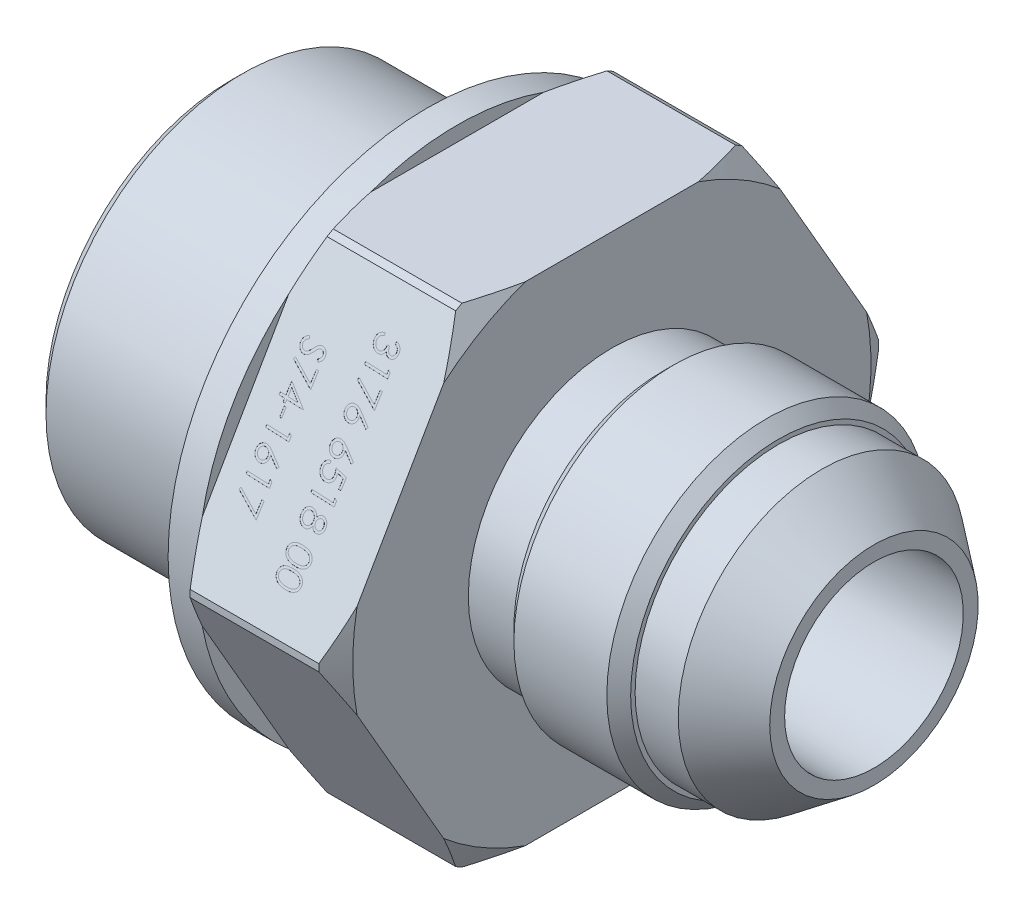
from build123d import *

# Parameters (mm, degrees)
SKETCH2_OUTSIDE_W  = 66.128
SKETCH2_OUTSIDE_H  = 66.128
EXTRUDE1_DEPTH     = 13
CHAMFER1_SIZE      = 1
CHAMFER2_SIZE      = 1
SKETCH4_R          = 1.75
CUT_EXTRUDE1_DEPTH = 0.01


with BuildPart() as part:
    # Sketch1 → Revolve1 (revolve)
    with BuildSketch(Plane.XY, mode=Mode.PRIVATE) as revolve1_sk:
        Polygon((0, 13.5), (0, 16.5), (14.25, 16.5), (16, 14.75), (19, 14.75), (19, 18.5), (16.5, 18.5), (16.5, 21.75), (19, 21.75), (20.1, 23.5), (30.9, 23.5), (32, 21.75), (32, 12.05), (36.2, 12.05), (36.2, 13.425), (46, 13.425), (46, 12.05), (49.620752089, 12.05), (54, 8.75), (54, 7.5), (24.603012167, 7.5), (22.5, 11), (4.330127019, 11), align=None)
    revolve(revolve1_sk.sketch.rotate(Axis((0, 0, 0), (1, 0, 0)), 90), axis=Axis((0, 0, 0), (1, 0, 0)))

    # Sketch2 outside → Extrude1 (cut)
    with BuildSketch(Plane(origin=(32, 0, 0), x_dir=(0, 0, -1), z_dir=(1, 0, 0))):
        Rectangle(SKETCH2_OUTSIDE_W, SKETCH2_OUTSIDE_H)
        Polygon((11.835680518, 20.5), (-11.835680518, 20.5), (-23.671361037, 0), (-11.835680518, -20.5), (11.835680518, -20.5), (23.671361037, 0), align=None, mode=Mode.SUBTRACT)
    extrude(amount=-EXTRUDE1_DEPTH, mode=Mode.SUBTRACT)

    # Chamfer1
    chamfer1_edges = [part.edges().sort_by_distance(p)[0] for p in [
        (0, 0, -16.5),
    ]]
    chamfer(chamfer1_edges, length=CHAMFER1_SIZE)

    # Chamfer2
    chamfer2_edges = [part.edges().sort_by_distance(p)[0] for p in [
        (36.2, 0, -13.425),
        (46, 0, -13.425),
    ]]
    chamfer(chamfer2_edges, length=CHAMFER2_SIZE)

    # Sketch5 → Cut-Extrude1 (cut)
    # profile 1 of 18: a face of its own
    with BuildSketch(Plane(origin=(0, 10.25, 17.753520778), x_dir=(1, 0, 0), z_dir=(0, 0.5000000000000002, 0.8660254037844386))):
        with BuildLine():
            Line((27.650196382, 7.860444696), (27.656606638, 8.063569696))
            add(Edge.make_bspline(
                [(27.656606638, 8.063569696), (27.676453297, 8.057952386), (27.715331515, 8.046948469), (27.771009739, 8.026426962), (27.823259056, 8.003191527), (27.871593757, 7.976418704), (27.91632679, 7.946475154), (27.957844535, 7.914220366), (27.995299851, 7.878264224), (28.028877361, 7.839339004), (28.058756486, 7.798331221), (28.084803062, 7.755584948), (28.105948847, 7.710896786), (28.123252749, 7.66466336), (28.136602125, 7.616842093), (28.1453664, 7.567341495), (28.149841401, 7.516246055), (28.149545214, 7.481712962), (28.1493951, 7.464210722)],
                knots=[0, 0, 0, 0, 1.172137387, 2.296135235, 3.369864205, 4.419848681, 5.432590616, 6.427332812, 7.404539987, 8.378646082, 9.345894802, 10.285888189, 11.219668811, 12.151719751, 13.089196089, 14.037764314, 15.005489571, 16, 16, 16, 16], degree=3))
            add(Edge.make_bspline(
                [(28.1493951, 7.464210722), (28.147771575, 7.438756682), (28.144555587, 7.388335564), (28.128387631, 7.314467075), (28.103878124, 7.243404727), (28.070727649, 7.176231447), (28.030613521, 7.114030284), (27.983339076, 7.059295759), (27.930580772, 7.011684509), (27.872032666, 6.973301737), (27.81066862, 6.942535378), (27.747041693, 6.921797392), (27.682517901, 6.908841648), (27.639038306, 6.908628147), (27.617343818, 6.908521619)],
                knots=[0, 0, 0, 0, 1.07481354, 2.129064788, 3.178592793, 4.239448185, 5.281828356, 6.292650681, 7.282287063, 8.269916473, 9.237526101, 10.169385846, 11.086600543, 12, 12, 12, 12], degree=3))
            add(Edge.make_bspline(
                [(27.617343818, 6.908521619), (27.596439413, 6.909963478), (27.555409418, 6.912793479), (27.495781944, 6.926610931), (27.440087566, 6.94881825), (27.388166262, 6.979162664), (27.33928512, 7.016445656), (27.294689566, 7.062491928), (27.25342217, 7.116082494), (27.230265641, 7.156220127), (27.218305356, 7.176951106)],
                knots=[0, 0, 0, 0, 0.993724257, 1.950426287, 2.89239005, 3.829882863, 4.797553611, 5.801922378, 6.864698842, 8, 8, 8, 8], degree=3))
            add(Edge.make_bspline(
                [(27.218305356, 7.176951106), (27.207447342, 7.154024393), (27.186122937, 7.108997881), (27.14367464, 7.048262066), (27.096517675, 6.992860763), (27.059338238, 6.962235682), (27.040821382, 6.946983158)],
                knots=[0, 0, 0, 0, 1.03559701, 2.03384237, 3.020774314, 4, 4, 4, 4], degree=3))
            add(Edge.make_bspline(
                [(27.040821382, 6.946983158), (27.027233666, 6.936985275), (27.000521822, 6.917330619), (26.95802674, 6.892463667), (26.914649586, 6.871466636), (26.870111024, 6.854666259), (26.824558651, 6.841682435), (26.778025694, 6.832997477), (26.730442539, 6.827814247), (26.69841934, 6.828199076), (26.682247664, 6.828393414)],
                knots=[0, 0, 0, 0, 1.050019051, 2.064213311, 3.061174903, 4.048269315, 5.025078277, 6.007078654, 6.993577196, 8, 8, 8, 8], degree=3))
            add(Edge.make_bspline(
                [(26.682247664, 6.828393414), (26.654363703, 6.830425867), (26.598786882, 6.834476843), (26.516953523, 6.854444238), (26.437615056, 6.8851985), (26.361522146, 6.926140933), (26.291166733, 6.976872965), (26.228559345, 7.035994731), (26.175109941, 7.103363669), (26.131094879, 7.177932913), (26.097055333, 7.258703478), (26.073346362, 7.344169666), (26.060161738, 7.43400808), (26.060089144, 7.495151374), (26.060052151, 7.526310081)],
                knots=[0, 0, 0, 0, 0.965127648, 1.923640923, 2.898436568, 3.900242364, 4.902207704, 5.88840422, 6.867508435, 7.865114395, 8.872605565, 9.888512698, 10.923983175, 12, 12, 12, 12], degree=3))
            add(Edge.make_bspline(
                [(26.060052151, 7.526310081), (26.061187371, 7.547307246), (26.063416119, 7.588530434), (26.072377309, 7.648687666), (26.085514534, 7.706115887), (26.103609421, 7.760664417), (26.126129131, 7.812549015), (26.152866557, 7.861753428), (26.185029235, 7.907561067), (26.220837037, 7.950954381), (26.261595905, 7.990736925), (26.306517684, 8.026870073), (26.355770757, 8.05893271), (26.408865616, 8.087587091), (26.466432506, 8.112027397), (26.528316035, 8.132177046), (26.594220255, 8.149362348), (26.63997361, 8.1570079), (26.663417535, 8.160925465)],
                knots=[0, 0, 0, 0, 1.04796899, 2.057450188, 3.028173702, 3.982033815, 4.918442935, 5.845238331, 6.768774909, 7.704876214, 8.646596964, 9.603311459, 10.574742671, 11.572761282, 12.607960066, 13.688158688, 14.815417194, 16, 16, 16, 16], degree=3))
            Line((26.663417535, 8.160925465), (26.65740792, 7.966213927))
            add(Edge.make_bspline(
                [(26.65740792, 7.966213927), (26.641602227, 7.962383941), (26.610974095, 7.954962229), (26.567111199, 7.941249488), (26.526645937, 7.925986234), (26.489179923, 7.90969129), (26.455011211, 7.891637142), (26.424065408, 7.872121601), (26.396596442, 7.850851231), (26.380434327, 7.835216907), (26.372552151, 7.827592132)],
                knots=[0, 0, 0, 0, 1.21569083, 2.355754931, 3.433237329, 4.448061022, 5.408370697, 6.319673987, 7.180514116, 8, 8, 8, 8], degree=3))
            add(Edge.make_bspline(
                [(26.372552151, 7.827592132), (26.363517894, 7.817487115), (26.345463445, 7.797292813), (26.322281544, 7.763718177), (26.302277987, 7.728185873), (26.285584848, 7.690361768), (26.272558141, 7.650321448), (26.262389071, 7.608023567), (26.256048303, 7.563475922), (26.254400538, 7.533006187), (26.253561766, 7.517495978)],
                knots=[0, 0, 0, 0, 0.956683987, 1.911878537, 2.874866935, 3.833641529, 4.82701498, 5.845206134, 6.903131151, 8, 8, 8, 8], degree=3))
            add(Edge.make_bspline(
                [(26.253561766, 7.517495978), (26.253402498, 7.499859973), (26.253091829, 7.465459147), (26.257559957, 7.414890056), (26.266241487, 7.36699186), (26.27926121, 7.321548469), (26.295967711, 7.278656928), (26.316945031, 7.23815055), (26.342402105, 7.200415266), (26.371405985, 7.165390245), (26.403556778, 7.133829952), (26.437363249, 7.105772396), (26.472884098, 7.08202507), (26.509672917, 7.062072553), (26.548084754, 7.046391496), (26.588209921, 7.035364393), (26.629588721, 7.027266886), (26.657903342, 7.025833504), (26.672231638, 7.025108158)],
                knots=[0, 0, 0, 0, 1.17238231, 2.286851296, 3.370385672, 4.404910174, 5.425811061, 6.426854921, 7.431870178, 8.44734812, 9.445906773, 10.42387273, 11.364843295, 12.282772421, 13.203061652, 14.116813556, 15.047034637, 16, 16, 16, 16], degree=3))
            add(Edge.make_bspline(
                [(26.672231638, 7.025108158), (26.691388563, 7.025114184), (26.729503013, 7.025126175), (26.785647877, 7.036938976), (26.840543178, 7.055107879), (26.892509504, 7.082715754), (26.941334095, 7.116313967), (26.98455398, 7.156684122), (27.021285306, 7.202976603), (27.047052601, 7.246104379), (27.06440966, 7.284655725), (27.076367014, 7.317621277), (27.087066636, 7.354341864), (27.097139477, 7.39480455), (27.105793632, 7.439218185), (27.113420252, 7.487457762), (27.119684624, 7.539466019), (27.123161527, 7.575447798), (27.124955997, 7.594018414)],
                knots=[0, 0, 0, 0, 1.124174802, 2.236648331, 3.35716584, 4.516774044, 5.684973627, 6.835604498, 7.981612616, 9.151158797, 9.780566934, 10.466566658, 11.212319458, 12.029779454, 12.918821475, 13.873353244, 14.902412814, 16, 16, 16, 16], degree=3))
            Line((27.124955997, 7.594018414), (27.307247664, 7.58840944))
            add(Edge.make_bspline(
                [(27.307247664, 7.58840944), (27.307025844, 7.566085342), (27.306590178, 7.52223951), (27.314285492, 7.458001666), (27.326842412, 7.396410346), (27.345918332, 7.338705093), (27.369683075, 7.286036367), (27.397080366, 7.240039595), (27.428287059, 7.201564962), (27.462961834, 7.170688508), (27.50080849, 7.147398442), (27.540358466, 7.129865821), (27.58203469, 7.118673082), (27.610600676, 7.116663106), (27.624955997, 7.115653029)],
                knots=[0, 0, 0, 0, 1.266649398, 2.48777353, 3.665839116, 4.83143701, 5.931117402, 6.941750704, 7.863314772, 8.733746411, 9.565001938, 10.376651275, 11.184215429, 12, 12, 12, 12], degree=3))
            add(Edge.make_bspline(
                [(27.624955997, 7.115653029), (27.635653597, 7.115512661), (27.656733294, 7.115236064), (27.687885896, 7.119575942), (27.717998946, 7.126670323), (27.747120225, 7.137259777), (27.775299205, 7.150980351), (27.80257098, 7.167849257), (27.828875689, 7.187988752), (27.85331525, 7.211706761), (27.876628501, 7.237277835), (27.896583485, 7.265580748), (27.913893966, 7.295333222), (27.928550984, 7.326751556), (27.939668674, 7.360276984), (27.948010721, 7.395542854), (27.953739223, 7.432526354), (27.955162058, 7.457780667), (27.955885484, 7.470620978)],
                knots=[0, 0, 0, 0, 0.94914833, 1.870303547, 2.78532686, 3.693479777, 4.61669532, 5.564879332, 6.537752708, 7.553098537, 8.586579427, 9.607110034, 10.622455863, 11.641606441, 12.680791212, 13.754087225, 14.858087344, 16, 16, 16, 16], degree=3))
            add(Edge.make_bspline(
                [(27.955885484, 7.470620978), (27.955826831, 7.491387407), (27.955712188, 7.531977083), (27.942970162, 7.590806249), (27.922273354, 7.645725226), (27.896647657, 7.68751798), (27.871941132, 7.718929498), (27.849453092, 7.741388131), (27.824241444, 7.763446653), (27.795780814, 7.784723849), (27.763783243, 7.804619746), (27.72898064, 7.824306929), (27.690854229, 7.843152653), (27.664011636, 7.85456898), (27.650196382, 7.860444696)],
                knots=[0, 0, 0, 0, 1.398847208, 2.734160724, 4.038791691, 5.345664829, 6.025916437, 6.73376287, 7.487945035, 8.286947782, 9.130076736, 10.030529682, 10.986359673, 12, 12, 12, 12], degree=3))
        make_face()
    # profile 2 of 18: a face of its own
    with BuildSketch(Plane(origin=(0, 10.25, 17.753520778), x_dir=(1, 0, 0), z_dir=(0, 0.5000000000000002, 0.8660254037844386))):
        Polygon((28.05846823, 6.162089482), (28.046048358, 5.771063841), (26.056865666, 5.833964482), (26.062875281, 6.031480508), (27.857346435, 5.974990123), (27.867362461, 6.287490123), align=None)
    # profile 3 of 18: a face of its own
    with BuildSketch(Plane(origin=(0, 10.25, 17.753520778), x_dir=(1, 0, 0), z_dir=(0, 0.5000000000000002, 0.8660254037844386))):
        Polygon((28.019624694, 4.938093243), (27.979961232, 3.676474653), (25.974352258, 4.805080423), (26.063294566, 4.965737474), (27.801675976, 3.990577218), (27.831724053, 4.944102859), align=None)
    # profile 4 of 18: a face of its own
    with BuildSketch(Plane(origin=(0, 10.25, 17.753520778), x_dir=(1, 0, 0), z_dir=(0, 0.5000000000000002, 0.8660254037844386))):
        with BuildLine():
            Line((27.995604875, 2.581885466), (27.883425388, 2.422029696))
            Line((27.883425388, 2.422029696), (27.086149747, 2.984529696))
            add(Edge.make_bspline(
                [(27.086149747, 2.984529696), (27.091275796, 2.966710226), (27.101285736, 2.931913093), (27.110607406, 2.87970616), (27.116296513, 2.829479457), (27.116230212, 2.79664339), (27.116197824, 2.780603414)],
                knots=[0, 0, 0, 0, 1.074262766, 2.097776358, 3.070789405, 4, 4, 4, 4], degree=3))
            add(Edge.make_bspline(
                [(27.116197824, 2.780603414), (27.115114896, 2.761201454), (27.112988847, 2.723110712), (27.103205351, 2.667210759), (27.08780244, 2.613912962), (27.067885947, 2.562558571), (27.042059532, 2.513996712), (27.010856994, 2.467834959), (26.974223062, 2.424338469), (26.933308933, 2.383168898), (26.888338367, 2.346340833), (26.840774522, 2.313842916), (26.7906781, 2.286969862), (26.738066168, 2.265700425), (26.683511271, 2.249204772), (26.626517024, 2.23782803), (26.567165907, 2.232342261), (26.526863909, 2.232464493), (26.506422183, 2.232526491)],
                knots=[0, 0, 0, 0, 1.020018928, 2.002543947, 2.972798418, 3.93018842, 4.890349605, 5.855315714, 6.851319346, 7.873073329, 8.899631523, 9.899628552, 10.894445876, 11.879196833, 12.875570896, 13.883922101, 14.926696244, 16, 16, 16, 16], degree=3))
            add(Edge.make_bspline(
                [(26.506422183, 2.232526491), (26.478424972, 2.234351738), (26.423397284, 2.237939208), (26.343422712, 2.255464895), (26.268011221, 2.283040219), (26.197457819, 2.32012001), (26.133334014, 2.366916565), (26.075614682, 2.421456958), (26.025759629, 2.48464128), (25.983562651, 2.554928016), (25.949956021, 2.630349953), (25.927112208, 2.709492566), (25.913592701, 2.790943137), (25.913513439, 2.846123855), (25.913473465, 2.873952773)],
                knots=[0, 0, 0, 0, 1.035768783, 2.035772815, 3.013197035, 3.995654912, 4.971033421, 5.938047287, 6.921583107, 7.935604847, 8.960902336, 9.963594408, 10.972993364, 12, 12, 12, 12], degree=3))
            add(Edge.make_bspline(
                [(25.913473465, 2.873952773), (25.915305657, 2.900753788), (25.918932246, 2.953802952), (25.936686926, 3.031245402), (25.963747288, 3.105480871), (26.000547828, 3.175641852), (26.045920026, 3.240681461), (26.100277947, 3.298044738), (26.162174559, 3.347706382), (26.230871144, 3.389245947), (26.304727965, 3.421301929), (26.381397733, 3.444601145), (26.46057408, 3.457403699), (26.513991324, 3.457591981), (26.540877311, 3.457686748)],
                knots=[0, 0, 0, 0, 1.012254044, 2.00362679, 2.9855434, 3.986181454, 4.984279168, 5.968029762, 6.957159246, 7.969902233, 8.987471821, 9.986954821, 10.986793364, 12, 12, 12, 12], degree=3))
            add(Edge.make_bspline(
                [(26.540877311, 3.457686748), (26.561487462, 3.456345813), (26.603365155, 3.453621173), (26.666667886, 3.441952334), (26.731196521, 3.424201352), (26.78566266, 3.40441977), (26.830686344, 3.385548908), (26.866245245, 3.368156656), (26.903582307, 3.348389179), (26.942721866, 3.326563803), (26.983266372, 3.301784922), (27.025765958, 3.275245033), (27.069410288, 3.245261818), (27.098992766, 3.224411124), (27.114194619, 3.213696363)],
                knots=[0, 0, 0, 0, 1.175062434, 2.38760534, 3.656616647, 4.981784098, 5.683632964, 6.435161718, 7.234405854, 8.088848273, 8.985965372, 9.939405984, 10.941101319, 12, 12, 12, 12], degree=3))
            Line((27.114194619, 3.213696363), (27.995604875, 2.581885466))
        make_face()
        with BuildLine():
            add(Edge.make_bspline(
                [(26.943521542, 2.83348803), (26.94367304, 2.847653059), (26.943972578, 2.875659876), (26.939459661, 2.917032725), (26.930907335, 2.956812895), (26.919144592, 2.995311473), (26.902149162, 3.031689709), (26.882834293, 3.067438237), (26.858294969, 3.100953954), (26.831089248, 3.133209879), (26.800741842, 3.162700147), (26.768353603, 3.188848277), (26.734015809, 3.210949307), (26.698300832, 3.229587314), (26.66062939, 3.244075842), (26.621292502, 3.254778582), (26.580143011, 3.262333648), (26.55199476, 3.26382098), (26.537672183, 3.264577773)],
                knots=[0, 0, 0, 0, 1.031555972, 2.039572071, 3.024399176, 3.993865807, 4.965137822, 5.94529028, 6.949824447, 7.985274567, 9.017518809, 10.028161909, 11.013373562, 11.988294885, 12.958737817, 13.947930333, 14.955852484, 16, 16, 16, 16], degree=3))
            add(Edge.make_bspline(
                [(26.537672183, 3.264577773), (26.523507209, 3.264560558), (26.495502349, 3.264526524), (26.454132326, 3.260131183), (26.414328447, 3.251596408), (26.37597037, 3.239669237), (26.33924702, 3.223384408), (26.30385451, 3.203378886), (26.270188987, 3.178988489), (26.23793581, 3.15174973), (26.208606813, 3.121415175), (26.182167708, 3.089388175), (26.160351267, 3.055126998), (26.141463115, 3.019683473), (26.127098033, 2.982077076), (26.116430648, 2.942875632), (26.108819286, 2.902004471), (26.107336831, 2.874120128), (26.106582439, 2.859930337)],
                knots=[0, 0, 0, 0, 1.033925617, 2.044122446, 3.031080114, 4.002644077, 4.972052056, 5.959106083, 6.965813448, 8.003503648, 9.037981036, 10.043222998, 11.030566046, 11.99894334, 12.971485716, 13.962818239, 14.963318468, 16, 16, 16, 16], degree=3))
            add(Edge.make_bspline(
                [(26.106582439, 2.859930337), (26.106599236, 2.845765169), (26.106632444, 2.817759926), (26.11103383, 2.776392707), (26.119546367, 2.736578514), (26.131591589, 2.698141239), (26.147639459, 2.661171102), (26.167851983, 2.625853564), (26.191708512, 2.591905236), (26.219059972, 2.559842433), (26.249333896, 2.530280583), (26.28172933, 2.504349771), (26.315616669, 2.481829749), (26.351622272, 2.46403927), (26.388962673, 2.448821797), (26.428260091, 2.438205176), (26.469196673, 2.431200319), (26.497046206, 2.429636859), (26.511229875, 2.428840594)],
                knots=[0, 0, 0, 0, 1.033355664, 2.042995621, 3.029409228, 4.000437616, 4.978242006, 5.964751919, 6.9652705, 8.002388673, 9.036295803, 10.048566993, 11.027196883, 11.999252012, 12.974819195, 13.965605245, 14.96388994, 16, 16, 16, 16], degree=3))
            add(Edge.make_bspline(
                [(26.511229875, 2.428840594), (26.525529772, 2.428681561), (26.553672662, 2.428368578), (26.595161749, 2.432938623), (26.635168907, 2.441355246), (26.673656348, 2.453844566), (26.710660007, 2.469978201), (26.746357814, 2.489583828), (26.779905865, 2.51405064), (26.812146167, 2.541280633), (26.841665288, 2.571606228), (26.867646377, 2.603968164), (26.890046426, 2.637986922), (26.908414813, 2.673765146), (26.923509044, 2.711236867), (26.93416542, 2.750513909), (26.941159601, 2.791455963), (26.94272453, 2.819304744), (26.943521542, 2.83348803)],
                knots=[0, 0, 0, 0, 1.041197392, 2.049126969, 3.033869542, 4.015482348, 4.991630289, 5.971698616, 6.97614656, 8.011507802, 9.043663443, 10.054219795, 11.031191837, 12.006029479, 12.979944002, 13.969051611, 14.965645162, 16, 16, 16, 16], degree=3))
        make_face(mode=Mode.SUBTRACT)
    # profile 5 of 18: a face of its own
    with BuildSketch(Plane(origin=(0, 10.25, 17.753520778), x_dir=(1, 0, 0), z_dir=(0, 0.5000000000000002, 0.8660254037844386))):
        with BuildLine():
            Line((27.922916494, 0.275338222), (27.810737007, 0.115482453))
            Line((27.810737007, 0.115482453), (27.013461366, 0.677982453))
            add(Edge.make_bspline(
                [(27.013461366, 0.677982453), (27.018587415, 0.660162982), (27.028597354, 0.62536585), (27.037919025, 0.573158916), (27.043608132, 0.522932213), (27.04354183, 0.490096147), (27.043509443, 0.474056171)],
                knots=[0, 0, 0, 0, 1.074262766, 2.097776358, 3.070789405, 4, 4, 4, 4], degree=3))
            add(Edge.make_bspline(
                [(27.043509443, 0.474056171), (27.042426515, 0.454654211), (27.040300466, 0.416563469), (27.030516969, 0.360663516), (27.015114059, 0.307365718), (26.995197565, 0.256011327), (26.969371151, 0.207449469), (26.938168613, 0.161287716), (26.90153468, 0.117791225), (26.860620551, 0.076621655), (26.815649985, 0.039793589), (26.768086141, 0.007295672), (26.717989719, -0.019577381), (26.665377786, -0.040846818), (26.61082289, -0.057342472), (26.553828642, -0.068719214), (26.494477526, -0.074204983), (26.454175528, -0.07408275), (26.433733802, -0.074020752)],
                knots=[0, 0, 0, 0, 1.020018928, 2.002543947, 2.972798418, 3.93018842, 4.890349605, 5.855315714, 6.851319346, 7.873073329, 8.899631523, 9.899628552, 10.894445876, 11.879196833, 12.875570896, 13.883922101, 14.926696244, 16, 16, 16, 16], degree=3))
            add(Edge.make_bspline(
                [(26.433733802, -0.074020752), (26.40573659, -0.072195505), (26.350708902, -0.068608036), (26.270734331, -0.051082348), (26.19532284, -0.023507024), (26.124769438, 0.013572767), (26.060645633, 0.060369322), (26.002926301, 0.114909715), (25.953071248, 0.178094037), (25.91087427, 0.248380773), (25.877267639, 0.323802709), (25.854423827, 0.402945323), (25.84090432, 0.484395894), (25.840825058, 0.539576612), (25.840785084, 0.56740553)],
                knots=[0, 0, 0, 0, 1.035768783, 2.035772815, 3.013197035, 3.995654912, 4.971033421, 5.938047287, 6.921583107, 7.935604847, 8.960902336, 9.963594408, 10.972993364, 12, 12, 12, 12], degree=3))
            add(Edge.make_bspline(
                [(25.840785084, 0.56740553), (25.842617276, 0.594206544), (25.846243864, 0.647255708), (25.863998545, 0.724698158), (25.891058906, 0.798933628), (25.927859446, 0.869094608), (25.973231645, 0.934134218), (26.027589565, 0.991497494), (26.089486178, 1.041159138), (26.158182762, 1.082698704), (26.232039583, 1.114754686), (26.308709352, 1.138053901), (26.387885698, 1.150856456), (26.441302943, 1.151044738), (26.46818893, 1.151139504)],
                knots=[0, 0, 0, 0, 1.012254044, 2.00362679, 2.9855434, 3.986181454, 4.984279168, 5.968029762, 6.957159246, 7.969902233, 8.987471821, 9.986954821, 10.986793364, 12, 12, 12, 12], degree=3))
            add(Edge.make_bspline(
                [(26.46818893, 1.151139504), (26.48879908, 1.14979857), (26.530676774, 1.14707393), (26.593979505, 1.13540509), (26.658508139, 1.117654109), (26.712974279, 1.097872526), (26.757997962, 1.079001665), (26.793556864, 1.061609412), (26.830893926, 1.041841935), (26.870033484, 1.020016559), (26.910577991, 0.995237679), (26.953077577, 0.96869779), (26.996721907, 0.938714575), (27.026304385, 0.917863881), (27.041506238, 0.90714912)],
                knots=[0, 0, 0, 0, 1.175062434, 2.38760534, 3.656616647, 4.981784098, 5.683632964, 6.435161718, 7.234405854, 8.088848273, 8.985965372, 9.939405984, 10.941101319, 12, 12, 12, 12], degree=3))
            Line((27.041506238, 0.90714912), (27.922916494, 0.275338222))
        make_face()
        with BuildLine():
            add(Edge.make_bspline(
                [(26.870833161, 0.526940786), (26.870984658, 0.541105816), (26.871284197, 0.569112633), (26.86677128, 0.610485482), (26.858218954, 0.650265651), (26.846456211, 0.68876423), (26.829460781, 0.725142466), (26.810145911, 0.760890993), (26.785606588, 0.79440671), (26.758400867, 0.826662636), (26.72805346, 0.856152903), (26.695665222, 0.882301034), (26.661327428, 0.904402063), (26.62561245, 0.923040071), (26.587941008, 0.937528599), (26.548604121, 0.948231339), (26.50745463, 0.955786405), (26.479306379, 0.957273736), (26.464983802, 0.95803053)],
                knots=[0, 0, 0, 0, 1.031555972, 2.039572071, 3.024399176, 3.993865807, 4.965137822, 5.94529028, 6.949824447, 7.985274567, 9.017518809, 10.028161909, 11.013373562, 11.988294885, 12.958737817, 13.947930333, 14.955852484, 16, 16, 16, 16], degree=3))
            add(Edge.make_bspline(
                [(26.464983802, 0.95803053), (26.450818827, 0.958013315), (26.422813968, 0.95797928), (26.381443945, 0.95358394), (26.341640065, 0.945049164), (26.303281989, 0.933121994), (26.266558639, 0.916837165), (26.231166129, 0.896831643), (26.197500605, 0.872441246), (26.165247429, 0.845202487), (26.135918432, 0.814867931), (26.109479327, 0.782840932), (26.087662886, 0.748579754), (26.068774733, 0.71313623), (26.054409651, 0.675529833), (26.043742267, 0.636328389), (26.036130904, 0.595457227), (26.03464845, 0.567572885), (26.033894058, 0.553383094)],
                knots=[0, 0, 0, 0, 1.033925617, 2.044122446, 3.031080114, 4.002644077, 4.972052056, 5.959106083, 6.965813448, 8.003503648, 9.037981036, 10.043222998, 11.030566046, 11.99894334, 12.971485716, 13.962818239, 14.963318468, 16, 16, 16, 16], degree=3))
            add(Edge.make_bspline(
                [(26.033894058, 0.553383094), (26.033910855, 0.539217926), (26.033944062, 0.511212682), (26.038345449, 0.469845463), (26.046857986, 0.43003127), (26.058903207, 0.391593995), (26.074951078, 0.354623859), (26.095163602, 0.319306321), (26.119020131, 0.285357993), (26.14637159, 0.25329519), (26.176645515, 0.223733339), (26.209040949, 0.197802528), (26.242928287, 0.175282506), (26.278933891, 0.157492027), (26.316274292, 0.142274553), (26.355571709, 0.131657932), (26.396508292, 0.124653075), (26.424357825, 0.123089615), (26.438541494, 0.12229335)],
                knots=[0, 0, 0, 0, 1.033355664, 2.042995621, 3.029409228, 4.000437616, 4.978242006, 5.964751919, 6.9652705, 8.002388673, 9.036295803, 10.048566993, 11.027196883, 11.999252012, 12.974819195, 13.965605245, 14.96388994, 16, 16, 16, 16], degree=3))
            add(Edge.make_bspline(
                [(26.438541494, 0.12229335), (26.452841391, 0.122134318), (26.480984281, 0.121821334), (26.522473368, 0.126391379), (26.562480526, 0.134808003), (26.600967966, 0.147297322), (26.637971626, 0.163430957), (26.673669433, 0.183036584), (26.707217484, 0.207503397), (26.739457786, 0.234733389), (26.768976907, 0.265058985), (26.794957996, 0.29742092), (26.817358044, 0.331439679), (26.835726431, 0.367217902), (26.850820662, 0.404689623), (26.861477039, 0.443966666), (26.86847122, 0.48490872), (26.870036148, 0.5127575), (26.870833161, 0.526940786)],
                knots=[0, 0, 0, 0, 1.041197392, 2.049126969, 3.033869542, 4.015482348, 4.991630289, 5.971698616, 6.97614656, 8.011507802, 9.043663443, 10.054219795, 11.031191837, 12.006029479, 12.979944002, 13.969051611, 14.965645162, 16, 16, 16, 16], degree=3))
        make_face(mode=Mode.SUBTRACT)
    # profile 6 of 18: a face of its own
    with BuildSketch(Plane(origin=(0, 10.25, 17.753520778), x_dir=(1, 0, 0), z_dir=(0, 0.5000000000000002, 0.8660254037844386))):
        with BuildLine():
            Line((27.813560137, -1.606911222), (27.624056932, -1.600901607))
            Line((27.624056932, -1.600901607), (27.64649283, -0.892167633))
            Line((27.64649283, -0.892167633), (27.107230009, -0.776382376))
            add(Edge.make_bspline(
                [(27.107230009, -0.776382376), (27.11229535, -0.797562362), (27.122116286, -0.838627171), (27.132173117, -0.899232458), (27.137717278, -0.956561631), (27.137691278, -0.993652748), (27.137678727, -1.011558658)],
                knots=[0, 0, 0, 0, 1.09839137, 2.129615824, 3.097063312, 4, 4, 4, 4], degree=3))
            add(Edge.make_bspline(
                [(27.137678727, -1.011558658), (27.136556577, -1.033777635), (27.134360339, -1.077263935), (27.122965633, -1.140623802), (27.107198949, -1.200954305), (27.085544368, -1.258295985), (27.057622807, -1.312092823), (27.024529989, -1.36299626), (26.986035832, -1.410814668), (26.941980705, -1.45471613), (26.893658306, -1.494076754), (26.84241274, -1.528904246), (26.78769035, -1.557362699), (26.730290316, -1.580963787), (26.669418667, -1.597830587), (26.60582181, -1.610148085), (26.539100638, -1.615997196), (26.493723257, -1.615817068), (26.470611419, -1.615725325)],
                knots=[0, 0, 0, 0, 1.057842833, 2.070377637, 3.057088217, 4.022692461, 4.980673146, 5.936183688, 6.907980908, 7.896736486, 8.890423544, 9.870561457, 10.84004876, 11.820866517, 12.818772727, 13.840956799, 14.900345169, 16, 16, 16, 16], degree=3))
            add(Edge.make_bspline(
                [(26.470611419, -1.615725325), (26.454430845, -1.615044102), (26.422370437, -1.613694319), (26.374947788, -1.607228734), (26.328462599, -1.599085736), (26.283114939, -1.587756314), (26.238836697, -1.573869342), (26.196055572, -1.556404751), (26.154121753, -1.536749266), (26.11351515, -1.514497275), (26.074731072, -1.489690715), (26.038173926, -1.462813514), (26.004010585, -1.433926522), (25.972407021, -1.403018694), (25.942981276, -1.370467896), (25.916004559, -1.336048841), (25.892042141, -1.299232986), (25.869925517, -1.260995736), (25.850679025, -1.220799116), (25.834317483, -1.179130202), (25.820542285, -1.136057141), (25.809983536, -1.091540021), (25.801192727, -1.045743907), (25.796441413, -0.998429858), (25.793175131, -0.949767397), (25.793940682, -0.916878713), (25.794329368, -0.900180453)],
                knots=[0, 0, 0, 0, 1.056179086, 2.092727375, 3.120003499, 4.13448559, 5.140398251, 6.145291272, 7.147119145, 8.161114576, 9.164305893, 10.149047106, 11.119769521, 12.081098324, 13.03130394, 13.981309745, 14.931155669, 15.895284599, 16.861891356, 17.836049691, 18.814408344, 19.809886929, 20.820018219, 21.854513209, 22.910692295, 24, 24, 24, 24], degree=3))
            add(Edge.make_bspline(
                [(25.794329368, -0.900180453), (25.795299033, -0.880381453), (25.79720801, -0.841403212), (25.806302893, -0.784459817), (25.819470342, -0.729849584), (25.837379866, -0.677886938), (25.860217782, -0.628545327), (25.886867233, -0.581455761), (25.918894626, -0.537289595), (25.954833652, -0.495745073), (25.994243137, -0.457535179), (26.036479359, -0.423134342), (26.081709131, -0.393481495), (26.12926383, -0.367587442), (26.179868072, -0.347059612), (26.232410273, -0.329377086), (26.287929117, -0.317129527), (26.325936579, -0.312157153), (26.345210778, -0.309635581)],
                knots=[0, 0, 0, 0, 1.07239384, 2.111219069, 3.115926481, 4.110464608, 5.080931862, 6.055644377, 7.034717206, 8.029018822, 9.025971389, 10.002612332, 10.973079586, 11.949907813, 12.928660299, 13.925429364, 14.947951622, 16, 16, 16, 16], degree=3))
            Line((26.345210778, -0.309635581), (26.338800522, -0.513962504))
            add(Edge.make_bspline(
                [(26.338800522, -0.513962504), (26.320266291, -0.517410647), (26.284607104, -0.524044749), (26.234515889, -0.540526781), (26.189257077, -0.560112435), (26.149485246, -0.585076496), (26.113958566, -0.614015459), (26.08211725, -0.647583822), (26.053720241, -0.685912241), (26.028579467, -0.728117456), (26.007988547, -0.773247316), (25.992438186, -0.820354213), (25.982770348, -0.868828199), (25.980540866, -0.90174299), (25.979425522, -0.918209299)],
                knots=[0, 0, 0, 0, 1.149262506, 2.211139286, 3.210766575, 4.15155085, 5.066746578, 6.000621695, 6.96721047, 7.972172499, 8.993361826, 9.988193434, 10.99355195, 12, 12, 12, 12], degree=3))
            add(Edge.make_bspline(
                [(25.979425522, -0.918209299), (25.979336472, -0.934253035), (25.979159991, -0.966048814), (25.985119373, -1.012869046), (25.99484807, -1.058277665), (26.010507148, -1.101750389), (26.030150938, -1.143889422), (26.054122533, -1.184768511), (26.08396958, -1.223144916), (26.117098285, -1.260213617), (26.154143349, -1.294034635), (26.19413231, -1.323960189), (26.236568471, -1.349536744), (26.281442941, -1.371065186), (26.328878571, -1.387871158), (26.378832986, -1.400116853), (26.431068916, -1.40885202), (26.466837718, -1.41080533), (26.485034496, -1.411799043)],
                knots=[0, 0, 0, 0, 0.97777861, 1.937780125, 2.872702116, 3.805456271, 4.74945693, 5.706550182, 6.68910285, 7.710084523, 8.73654484, 9.743518279, 10.752302735, 11.754419759, 12.774848698, 13.816170907, 14.889013594, 16, 16, 16, 16], degree=3))
            add(Edge.make_bspline(
                [(26.485034496, -1.411799043), (26.501471467, -1.41196816), (26.533612036, -1.412298848), (26.580799223, -1.407669673), (26.625862302, -1.399577335), (26.668493296, -1.386356448), (26.709314689, -1.370238186), (26.747348931, -1.349069645), (26.783511826, -1.324507516), (26.816824909, -1.295751232), (26.847480929, -1.263685034), (26.874206863, -1.228391929), (26.8974624, -1.190396083), (26.916013528, -1.149338722), (26.931489291, -1.105853164), (26.942596675, -1.059520289), (26.94983528, -1.010430656), (26.95165244, -0.976726936), (26.952582573, -0.959475325)],
                knots=[0, 0, 0, 0, 1.075618367, 2.103245552, 3.099705214, 4.067947355, 5.021146226, 5.968188224, 6.911711336, 7.879163397, 8.844082858, 9.811258239, 10.772565168, 11.754647603, 12.755815607, 13.790820286, 14.869207668, 16, 16, 16, 16], degree=3))
            add(Edge.make_bspline(
                [(26.952582573, -0.959475325), (26.952618743, -0.944381261), (26.952693089, -0.913356425), (26.949497332, -0.865677328), (26.942398538, -0.815694086), (26.932343168, -0.763292007), (26.919183391, -0.708280085), (26.901984816, -0.651128054), (26.882648157, -0.591199759), (26.867176522, -0.551018359), (26.859233214, -0.530388786)],
                knots=[0, 0, 0, 0, 0.819539083, 1.684507715, 2.592201622, 3.559395112, 4.581374116, 5.662254982, 6.799775995, 8, 8, 8, 8], degree=3))
            Line((26.859233214, -0.530388786), (27.840803727, -0.745533017))
            Line((27.840803727, -0.745533017), (27.813560137, -1.606911222))
        make_face()
    # profile 7 of 18: a face of its own
    with BuildSketch(Plane(origin=(0, 10.25, 17.753520778), x_dir=(1, 0, 0), z_dir=(0, 0.5000000000000002, 0.8660254037844386))):
        Polygon((27.791944165, -2.29525041), (27.779524293, -2.686276051), (25.790341601, -2.62337541), (25.796351216, -2.425859385), (27.59082237, -2.482349769), (27.600838396, -2.169849769), align=None)
    # profile 8 of 18: a face of its own
    with BuildSketch(Plane(origin=(0, 10.25, 17.753520778), x_dir=(1, 0, 0), z_dir=(0, 0.5000000000000002, 0.8660254037844386))):
        with BuildLine():
            add(Edge.make_bspline(
                [(26.828020501, -4.356185752), (26.81924328, -4.372177443), (26.802031803, -4.40353596), (26.774013093, -4.447672805), (26.745580793, -4.488462822), (26.716145801, -4.525400611), (26.686396258, -4.559199548), (26.655192835, -4.588909052), (26.623787975, -4.615581638), (26.591006802, -4.63810107), (26.557392615, -4.657391865), (26.523152149, -4.674404617), (26.48759461, -4.687829106), (26.451306589, -4.699367108), (26.413744351, -4.707621907), (26.375187149, -4.71322912), (26.335677496, -4.716165893), (26.309060684, -4.715764313), (26.295568578, -4.715560752)],
                knots=[0, 0, 0, 0, 1.283595946, 2.517036155, 3.677441973, 4.781312878, 5.839751478, 6.843526914, 7.811092439, 8.736658916, 9.637851375, 10.537424879, 11.424139607, 12.31005693, 13.215357298, 14.127220894, 15.050685111, 16, 16, 16, 16], degree=3))
            add(Edge.make_bspline(
                [(26.295568578, -4.715560752), (26.276704603, -4.714581023), (26.239455246, -4.712646421), (26.184604527, -4.703573642), (26.131563237, -4.689882146), (26.080199353, -4.671851752), (26.030599201, -4.649403822), (25.983118665, -4.621831386), (25.937296843, -4.589905932), (25.908875289, -4.565315011), (25.894526911, -4.552900496)],
                knots=[0, 0, 0, 0, 1.024572899, 2.023151738, 3.011152112, 3.994595474, 4.974184909, 5.961334109, 6.970796962, 8, 8, 8, 8], degree=3))
            add(Edge.make_bspline(
                [(25.894526911, -4.552900496), (25.877803002, -4.536601884), (25.844552315, -4.504196779), (25.802505146, -4.448776369), (25.767277589, -4.388743731), (25.738757564, -4.324124626), (25.717537042, -4.25455445), (25.703308091, -4.180565991), (25.695479668, -4.10181646), (25.695961486, -4.04784243), (25.696209603, -4.020047931)],
                knots=[0, 0, 0, 0, 0.952963027, 1.894693169, 2.831336481, 3.791348273, 4.773294375, 5.796203574, 6.865131674, 8, 8, 8, 8], degree=3))
            add(Edge.make_bspline(
                [(25.696209603, -4.020047931), (25.697624632, -3.993296011), (25.700367217, -3.941445897), (25.711856744, -3.866411529), (25.728301512, -3.796373488), (25.751310576, -3.731775171), (25.779293018, -3.67191002), (25.814076821, -3.617883693), (25.853837701, -3.568272135), (25.899727448, -3.525033418), (25.948636307, -3.487046803), (25.998916279, -3.45400671), (26.05012105, -3.425984214), (26.102455599, -3.403617993), (26.155976724, -3.386494799), (26.210475415, -3.375053655), (26.26600988, -3.368181345), (26.303295324, -3.36846383), (26.322010885, -3.368605624)],
                knots=[0, 0, 0, 0, 1.270358425, 2.462186928, 3.596364636, 4.678553518, 5.710201483, 6.724423167, 7.719946444, 8.719333814, 9.707977376, 10.655225821, 11.571033063, 12.473748313, 13.351455608, 14.232564131, 15.11282928, 16, 16, 16, 16], degree=3))
            add(Edge.make_bspline(
                [(26.322010885, -3.368605624), (26.335643585, -3.369386938), (26.362722514, -3.370938881), (26.402842937, -3.375954339), (26.441705286, -3.384633699), (26.479547247, -3.39530088), (26.516105515, -3.40901146), (26.551486815, -3.425456263), (26.585675763, -3.444901634), (26.619074142, -3.466859959), (26.651323071, -3.492376813), (26.682578364, -3.521253355), (26.712827884, -3.553854006), (26.741352725, -3.590528046), (26.769743489, -3.630222139), (26.796411271, -3.674189764), (26.822433519, -3.721610292), (26.838334806, -3.755007139), (26.846449988, -3.772051137)],
                knots=[0, 0, 0, 0, 0.933663927, 1.854557046, 2.760890936, 3.654016646, 4.54114627, 5.427711681, 6.319155069, 7.228428626, 8.158333538, 9.127712351, 10.135805565, 11.195482016, 12.302726545, 13.471134335, 14.709399719, 16, 16, 16, 16], degree=3))
            add(Edge.make_bspline(
                [(26.846449988, -3.772051137), (26.86011711, -3.749422716), (26.886614621, -3.705551239), (26.933266687, -3.646971219), (26.984499115, -3.597884906), (27.039845247, -3.558407382), (27.097973904, -3.527532404), (27.158738809, -3.506849048), (27.221023428, -3.493883418), (27.263187174, -3.49369846), (27.284350629, -3.493605624)],
                knots=[0, 0, 0, 0, 1.159419083, 2.247855829, 3.27605445, 4.263392554, 5.222989303, 6.153557068, 7.073205873, 8, 8, 8, 8], degree=3))
            add(Edge.make_bspline(
                [(27.284350629, -3.493605624), (27.305949971, -3.495208863), (27.349327157, -3.498428592), (27.413375274, -3.515569672), (27.475913607, -3.542429982), (27.53646417, -3.578466621), (27.593318824, -3.622509371), (27.644734526, -3.674204894), (27.687778216, -3.734306604), (27.724599182, -3.800060785), (27.753371351, -3.870872197), (27.773342331, -3.944993821), (27.785178494, -4.021662465), (27.785160833, -4.073559012), (27.785151911, -4.099775496)],
                knots=[0, 0, 0, 0, 0.894085494, 1.795559899, 2.725937798, 3.701490359, 4.70122274, 5.69314519, 6.704976867, 7.748285325, 8.803569188, 9.856581831, 10.917213389, 12, 12, 12, 12], degree=3))
            add(Edge.make_bspline(
                [(27.785151911, -4.099775496), (27.783585828, -4.125242819), (27.780489911, -4.175588008), (27.763558905, -4.249042279), (27.739529337, -4.319724753), (27.705495941, -4.385845698), (27.66518863, -4.447229989), (27.61720952, -4.501277395), (27.563749521, -4.548797947), (27.504106883, -4.58764767), (27.441103576, -4.618485681), (27.375998452, -4.640474602), (27.309423566, -4.653075709), (27.264636768, -4.653332985), (27.242283321, -4.653461393)],
                knots=[0, 0, 0, 0, 1.066301014, 2.107921795, 3.143857602, 4.183797186, 5.211663455, 6.209717176, 7.199881766, 8.196760799, 9.179243256, 10.128469639, 11.065904343, 12, 12, 12, 12], degree=3))
            add(Edge.make_bspline(
                [(27.242283321, -4.653461393), (27.220282251, -4.652017504), (27.177232139, -4.649192207), (27.1150962, -4.633203689), (27.056613445, -4.609711116), (27.002452404, -4.57622828), (26.952329577, -4.533930854), (26.906287005, -4.482974388), (26.863611703, -4.423580936), (26.840177524, -4.379206183), (26.828020501, -4.356185752)],
                knots=[0, 0, 0, 0, 0.981580679, 1.920686427, 2.847698222, 3.783529738, 4.747601627, 5.763801288, 6.839920149, 8, 8, 8, 8], degree=3))
        make_face()
        with BuildLine():
            add(Edge.make_bspline(
                [(27.591642295, -4.083749855), (27.591700054, -4.07039173), (27.591813449, -4.044166), (27.588727046, -4.005656743), (27.582049072, -3.968880751), (27.57327559, -3.933510315), (27.559935537, -3.900095985), (27.544638907, -3.867912611), (27.525474367, -3.837800731), (27.504004656, -3.809428689), (27.480281562, -3.783623014), (27.454708651, -3.761080943), (27.4284128, -3.741256996), (27.400500116, -3.724969915), (27.371165108, -3.712719542), (27.340736387, -3.703313512), (27.309015087, -3.697220072), (27.287314117, -3.695830767), (27.276337808, -3.69512806)],
                knots=[0, 0, 0, 0, 1.150697682, 2.259141059, 3.322285237, 4.368861877, 5.39241434, 6.416484075, 7.434914366, 8.4613086, 9.479153718, 10.449041673, 11.394879076, 12.312582226, 13.22514941, 14.12779709, 15.053043428, 16, 16, 16, 16], degree=3))
            add(Edge.make_bspline(
                [(27.276337808, -3.69512806), (27.265371234, -3.695131179), (27.243608107, -3.695137368), (27.211228245, -3.699826814), (27.179591023, -3.707677633), (27.148690753, -3.719716219), (27.118345975, -3.734735065), (27.088738923, -3.753932185), (27.060139889, -3.776853944), (27.032170915, -3.802608243), (27.006582523, -3.831153475), (26.983492485, -3.861114501), (26.964331799, -3.892751074), (26.947559815, -3.925201558), (26.934734095, -3.95937699), (26.925771848, -3.99490654), (26.918879172, -4.03155148), (26.917608058, -4.056607645), (26.916962808, -4.069326778)],
                knots=[0, 0, 0, 0, 0.91918898, 1.824127172, 2.737353782, 3.648928738, 4.601133647, 5.574082218, 6.603171056, 7.673650308, 8.760660339, 9.816314174, 10.842653638, 11.860021754, 12.877821808, 13.897101402, 14.932516416, 16, 16, 16, 16], degree=3))
            add(Edge.make_bspline(
                [(26.916962808, -4.069326778), (26.917051586, -4.085651458), (26.91722729, -4.117960367), (26.925365355, -4.165999085), (26.938850435, -4.212879024), (26.958542202, -4.258101572), (26.983488804, -4.300411861), (27.01379746, -4.338342239), (27.048691883, -4.371655386), (27.08765458, -4.399676106), (27.128948035, -4.422544352), (27.171375333, -4.43881301), (27.213773184, -4.450501931), (27.242477513, -4.452534143), (27.256706398, -4.453541521)],
                knots=[0, 0, 0, 0, 1.034234332, 2.046899656, 3.079223402, 4.122786243, 5.167552238, 6.186436794, 7.193236696, 8.218582844, 9.223419997, 10.178479086, 11.097062627, 12, 12, 12, 12], degree=3))
            add(Edge.make_bspline(
                [(27.256706398, -4.453541521), (27.266731315, -4.453469187), (27.286584201, -4.453325941), (27.316165421, -4.449679), (27.345084443, -4.442687212), (27.373647675, -4.433204382), (27.401515082, -4.42015794), (27.428730972, -4.403986344), (27.455733664, -4.385067175), (27.481935782, -4.363310416), (27.506608168, -4.338516002), (27.528077774, -4.310412548), (27.546896768, -4.279639192), (27.561798579, -4.245813754), (27.574522197, -4.209454901), (27.583505904, -4.17007908), (27.589632611, -4.12786543), (27.59095993, -4.098728793), (27.591642295, -4.083749855)],
                knots=[0, 0, 0, 0, 0.863140914, 1.709324724, 2.560421221, 3.422641615, 4.297661174, 5.205274515, 6.146814245, 7.135193637, 8.135816784, 9.152904372, 10.174924896, 11.235583311, 12.330684231, 13.488755002, 14.708986806, 16, 16, 16, 16], degree=3))
        make_face(mode=Mode.SUBTRACT)
        with BuildLine():
            add(Edge.make_bspline(
                [(26.737074988, -4.06652229), (26.737258702, -4.049686531), (26.737619701, -4.016604296), (26.732722788, -3.967872485), (26.723287891, -3.921319639), (26.710718895, -3.876290845), (26.692930341, -3.833571385), (26.671095447, -3.792621768), (26.644951937, -3.753783502), (26.615125265, -3.717217833), (26.582440161, -3.6838169), (26.548035501, -3.653937729), (26.511856753, -3.628673278), (26.47426942, -3.607447248), (26.434950036, -3.591065088), (26.394212869, -3.579135463), (26.352118182, -3.570673051), (26.323386712, -3.56898332), (26.308789731, -3.568124855)],
                knots=[0, 0, 0, 0, 1.107008, 2.175268577, 3.214226053, 4.229132067, 5.245557972, 6.251756775, 7.277593356, 8.3204068, 9.351721353, 10.348478946, 11.313645315, 12.249744476, 13.183035994, 14.108687662, 15.039121588, 16, 16, 16, 16], degree=3))
            add(Edge.make_bspline(
                [(26.308789731, -3.568124855), (26.290720645, -3.568253835), (26.254706659, -3.56851091), (26.201352078, -3.578537518), (26.149506958, -3.596196495), (26.099359268, -3.62033146), (26.052487897, -3.651379822), (26.010820457, -3.689317818), (25.973895234, -3.73283633), (25.943213914, -3.782810252), (25.918370574, -3.837885231), (25.899873521, -3.897603747), (25.888290652, -3.961808813), (25.885528526, -4.006112973), (25.884110244, -4.028862034)],
                knots=[0, 0, 0, 0, 0.927189861, 1.848007207, 2.774765125, 3.735563004, 4.700665685, 5.653117098, 6.622408275, 7.624201312, 8.656288366, 9.719999588, 10.829277721, 12, 12, 12, 12], degree=3))
            add(Edge.make_bspline(
                [(25.884110244, -4.028862034), (25.883950896, -4.046498135), (25.883638869, -4.081032242), (25.888125222, -4.131577479), (25.896527335, -4.179573853), (25.908771414, -4.225053738), (25.925727247, -4.267719998), (25.946771551, -4.307669951), (25.971569685, -4.345258342), (26.000941849, -4.379355496), (26.03257102, -4.410351843), (26.066208042, -4.43744946), (26.101012621, -4.460759184), (26.137331969, -4.480200669), (26.175203077, -4.495560285), (26.214743769, -4.506599096), (26.255597229, -4.514652553), (26.283511287, -4.516109121), (26.297571783, -4.516842803)],
                knots=[0, 0, 0, 0, 1.183725513, 2.317910481, 3.401514948, 4.45226612, 5.474702493, 6.477484338, 7.479784925, 8.491349263, 9.493288754, 10.449816516, 11.387452549, 12.302123289, 13.211326942, 14.125294089, 15.055698224, 16, 16, 16, 16], degree=3))
            add(Edge.make_bspline(
                [(26.297571783, -4.516842803), (26.311213241, -4.516905341), (26.338338622, -4.517029693), (26.378575058, -4.511365507), (26.418123707, -4.502542398), (26.456101996, -4.487989232), (26.493511715, -4.470600763), (26.529096195, -4.447648811), (26.564198922, -4.421154725), (26.597804979, -4.390547194), (26.629162915, -4.357109933), (26.656561462, -4.320990513), (26.680522196, -4.283423721), (26.699548252, -4.243411374), (26.715436937, -4.201968046), (26.72712294, -4.158497937), (26.734241677, -4.113076311), (26.736122649, -4.082170134), (26.737074988, -4.06652229)],
                knots=[0, 0, 0, 0, 0.93887972, 1.866917038, 2.793310194, 3.725036268, 4.663555089, 5.631264515, 6.636240099, 7.691732802, 8.759669773, 9.790439487, 10.81179935, 11.824331248, 12.837908178, 13.867033264, 14.920075767, 16, 16, 16, 16], degree=3))
        make_face(mode=Mode.SUBTRACT)
    # profile 9 of 18: a face of its own
    with BuildSketch(Plane(origin=(0, 10.25, 17.753520778), x_dir=(1, 0, 0), z_dir=(0, 0.5000000000000002, 0.8660254037844386))):
        with BuildLine():
            add(Edge.make_bspline(
                [(26.688825709, -5.683165688), (26.720619939, -5.684442648), (26.782525267, -5.686928969), (26.872455773, -5.69372655), (26.956772875, -5.702911564), (27.035446884, -5.714228735), (27.108337912, -5.728887823), (27.175805619, -5.744823754), (27.237398915, -5.764282295), (27.29384505, -5.785743168), (27.345391412, -5.810338909), (27.393852434, -5.835733107), (27.438672977, -5.863957828), (27.480604991, -5.893823669), (27.518556411, -5.926384573), (27.553405509, -5.960755029), (27.585086395, -5.997040066), (27.613089078, -6.035691112), (27.63785703, -6.075593318), (27.65933794, -6.116638595), (27.676804124, -6.158839902), (27.691567674, -6.201965437), (27.702182634, -6.246254396), (27.709514926, -6.291513012), (27.713128072, -6.337751773), (27.712952802, -6.368924558), (27.712864171, -6.384688124)],
                knots=[0, 0, 0, 0, 1.640647747, 3.194442443, 4.64917649, 6.013550945, 7.291108452, 8.48193067, 9.586139969, 10.619426208, 11.592882005, 12.529395272, 13.438885557, 14.321841715, 15.181532678, 16.014184744, 16.844013044, 17.662159117, 18.472384456, 19.263929698, 20.047890378, 20.82529111, 21.611938817, 22.393081828, 23.187407841, 24, 24, 24, 24], degree=3))
            add(Edge.make_bspline(
                [(27.712864171, -6.384688124), (27.712069339, -6.400605991), (27.710493202, -6.43217086), (27.703339824, -6.478728832), (27.693576758, -6.524089262), (27.679713827, -6.568126214), (27.662553199, -6.610848334), (27.641908379, -6.652497927), (27.617933015, -6.692810045), (27.5905817, -6.731858283), (27.559848398, -6.769180974), (27.52511579, -6.803997229), (27.487366565, -6.836936449), (27.446292313, -6.867898085), (27.401794236, -6.896834512), (27.353526684, -6.923061148), (27.302160027, -6.947705457), (27.246991644, -6.969675642), (27.187991259, -6.989531723), (27.124206641, -7.00579744), (27.056006486, -7.019358474), (26.982959115, -7.029628629), (26.905440313, -7.037277865), (26.823090741, -7.041404329), (26.736098018, -7.043228171), (26.676538083, -7.041715039), (26.645957119, -7.040938124)],
                knots=[0, 0, 0, 0, 0.815840691, 1.61779864, 2.409450747, 3.190481362, 3.979291328, 4.765486973, 5.569076934, 6.37939307, 7.205294461, 8.042086588, 8.895351764, 9.769554589, 10.674578977, 11.611384272, 12.581293884, 13.591122557, 14.65104797, 15.76762088, 16.96022028, 18.211034694, 19.544414517, 20.948706467, 22.433317654, 24, 24, 24, 24], degree=3))
            add(Edge.make_bspline(
                [(26.645957119, -7.040938124), (26.615498383, -7.039656719), (26.556261421, -7.03716461), (26.469782106, -7.030405553), (26.388276572, -7.020792092), (26.311498104, -7.008953331), (26.239677103, -6.994175284), (26.172619656, -6.97666724), (26.110449094, -6.956204872), (26.052857071, -6.933435088), (25.999671305, -6.907855049), (25.949956451, -6.880733494), (25.903582837, -6.851554277), (25.861208532, -6.819655093), (25.82171719, -6.786523786), (25.785764149, -6.751168215), (25.753879938, -6.713320801), (25.724842796, -6.674129815), (25.699626148, -6.633195565), (25.677990682, -6.591108977), (25.659783434, -6.548021009), (25.645433043, -6.504032685), (25.634551696, -6.459013828), (25.626792024, -6.41312046), (25.623289028, -6.366048602), (25.623443463, -6.334478284), (25.623521222, -6.318582354)],
                knots=[0, 0, 0, 0, 1.562153358, 3.038117515, 4.44383816, 5.766989205, 7.017888088, 8.199770291, 9.316471356, 10.369984151, 11.370951271, 12.338781014, 13.270967372, 14.175694077, 15.054582606, 15.911125599, 16.755858576, 17.588079609, 18.408540113, 19.216576523, 20.010963723, 20.803048262, 21.584836663, 22.382518626, 23.185584067, 24, 24, 24, 24], degree=3))
            add(Edge.make_bspline(
                [(25.623521222, -6.318582354), (25.624368351, -6.302938502), (25.626054191, -6.271806268), (25.632472115, -6.225829281), (25.64242371, -6.181171428), (25.656344209, -6.138020584), (25.673023116, -6.096031391), (25.69316375, -6.055242186), (25.716989206, -6.016019279), (25.743751863, -5.977771482), (25.774167725, -5.941580116), (25.807532996, -5.907147031), (25.844698431, -5.875442731), (25.885188845, -5.846000782), (25.928521917, -5.818171451), (25.975234812, -5.792825312), (26.025456665, -5.770205559), (26.079085641, -5.749114738), (26.13705081, -5.730448078), (26.20024714, -5.715664936), (26.268483134, -5.702537919), (26.34226148, -5.693448765), (26.421332163, -5.685945427), (26.505827288, -5.68230273), (26.595615457, -5.680983862), (26.65717642, -5.682424855), (26.688825709, -5.683165688)],
                knots=[0, 0, 0, 0, 0.808454268, 1.608874008, 2.393250444, 3.167227633, 3.946833377, 4.723752291, 5.512328373, 6.313727184, 7.131067759, 7.950063782, 8.786031007, 9.649184865, 10.532690707, 11.442694348, 12.389778811, 13.374237045, 14.416359717, 15.529932849, 16.722455288, 18.001653552, 19.36538328, 20.82160125, 22.365944026, 24, 24, 24, 24], degree=3))
        make_face()
        with BuildLine():
            add(Edge.make_bspline(
                [(26.678809683, -5.87146697), (26.651567875, -5.870789187), (26.598824809, -5.869476927), (26.522140444, -5.869916628), (26.450652423, -5.87216989), (26.384116622, -5.87663661), (26.322689704, -5.882635218), (26.266365564, -5.891779582), (26.214961849, -5.90166802), (26.168537607, -5.9148279), (26.125842242, -5.929339725), (26.086083474, -5.945776282), (26.04870902, -5.964196761), (26.013923649, -5.984589399), (25.981577221, -6.006720491), (25.951832927, -6.030835027), (25.924593309, -6.056800661), (25.892407716, -6.09333504), (25.858736663, -6.141381436), (25.828392352, -6.202469373), (25.808693566, -6.265867126), (25.805164174, -6.309369117), (25.803409042, -6.331002226)],
                knots=[0, 0, 0, 0, 1.479255793, 2.863998099, 4.162451933, 5.361334226, 6.483822404, 7.511258331, 8.458191119, 9.32360097, 10.128335469, 10.905187691, 11.657393458, 12.388515904, 13.092350031, 13.783030038, 14.465018047, 15.132714049, 16.423922115, 17.63653576, 18.824672638, 20, 20, 20, 20], degree=3))
            add(Edge.make_bspline(
                [(25.803409042, -6.331002226), (25.803662058, -6.352852931), (25.804166312, -6.396400791), (25.819614537, -6.460739991), (25.845203011, -6.522956526), (25.87491193, -6.572604191), (25.904647661, -6.609825091), (25.929303303, -6.637403449), (25.957656465, -6.662540198), (25.988536911, -6.686107398), (26.022006783, -6.708422124), (26.058469002, -6.728554461), (26.097531966, -6.747726061), (26.125039541, -6.758546262), (26.139146222, -6.764095175)],
                knots=[0, 0, 0, 0, 1.33724365, 2.665090111, 4.028488459, 5.454847898, 6.195812564, 6.949846556, 7.721527591, 8.516396136, 9.332273637, 10.187054638, 11.070269128, 12, 12, 12, 12], degree=3))
            add(Edge.make_bspline(
                [(26.139146222, -6.764095175), (26.156977021, -6.770566779), (26.19340175, -6.783786961), (26.250214312, -6.800236576), (26.309738228, -6.815314975), (26.37208233, -6.827564062), (26.43720193, -6.837478836), (26.504930153, -6.845579693), (26.575509075, -6.851106993), (26.623513465, -6.853182452), (26.647960324, -6.854239406)],
                knots=[0, 0, 0, 0, 0.876860011, 1.791248316, 2.73326227, 3.715384773, 4.727562795, 5.77840602, 6.868624364, 8, 8, 8, 8], degree=3))
            add(Edge.make_bspline(
                [(26.647960324, -6.854239406), (26.672398733, -6.854790354), (26.720205591, -6.855868129), (26.790209006, -6.854919704), (26.856936717, -6.852547935), (26.920213111, -6.846501755), (26.98031123, -6.839750018), (27.036946803, -6.829924612), (27.090383676, -6.818535167), (27.140506501, -6.804452921), (27.187404877, -6.788410125), (27.231184079, -6.770843581), (27.271732397, -6.75159522), (27.309268729, -6.730871715), (27.34321013, -6.707913005), (27.374462146, -6.683778336), (27.402544231, -6.657926202), (27.434611042, -6.621165469), (27.468560983, -6.57347254), (27.498605703, -6.512794534), (27.518084233, -6.449935129), (27.521600595, -6.406989141), (27.523360965, -6.385489406)],
                knots=[0, 0, 0, 0, 1.328006118, 2.597869634, 3.803417649, 4.954339817, 6.050531534, 7.088326618, 8.076034106, 9.017903294, 9.915084519, 10.767983343, 11.579378638, 12.352496942, 13.095083223, 13.803378425, 14.496496259, 15.164747495, 16.45108792, 17.664709936, 18.830900849, 20, 20, 20, 20], degree=3))
            add(Edge.make_bspline(
                [(27.523360965, -6.385489406), (27.522897395, -6.363651988), (27.52196812, -6.319876596), (27.507116503, -6.255002459), (27.480104081, -6.192511943), (27.449850088, -6.142634116), (27.420173864, -6.104503058), (27.3950571, -6.076973775), (27.367140172, -6.050991925), (27.336215926, -6.0272066), (27.303023066, -6.004638069), (27.266861624, -5.984156291), (27.228282782, -5.964984121), (27.186405902, -5.94755488), (27.140668225, -5.931843131), (27.090125672, -5.917790379), (27.034227264, -5.90619456), (26.973409688, -5.894980583), (26.906988724, -5.887137461), (26.835571057, -5.879672685), (26.758853664, -5.874641801), (26.706058432, -5.872547753), (26.678809683, -5.87146697)],
                knots=[0, 0, 0, 0, 1.183426277, 2.372301975, 3.584053498, 4.865858075, 5.527090687, 6.204419769, 6.886657798, 7.594304139, 8.320133934, 9.063737991, 9.848298914, 10.657426047, 11.524006155, 12.471995279, 13.502841579, 14.621975238, 15.827748886, 17.131907478, 18.519716132, 20, 20, 20, 20], degree=3))
        make_face(mode=Mode.SUBTRACT)
    # profile 10 of 18: a face of its own
    with BuildSketch(Plane(origin=(0, 10.25, 17.753520778), x_dir=(1, 0, 0), z_dir=(0, 0.5000000000000002, 0.8660254037844386))):
        with BuildLine():
            add(Edge.make_bspline(
                [(26.640366788, -7.22086385), (26.672161018, -7.222140811), (26.734066346, -7.224627132), (26.823996852, -7.231424713), (26.908313955, -7.240609726), (26.986987963, -7.251926898), (27.059878991, -7.266585985), (27.127346699, -7.282521917), (27.188939994, -7.301980457), (27.245386129, -7.32344133), (27.296932491, -7.348037072), (27.345393513, -7.37343127), (27.390214056, -7.40165599), (27.43214607, -7.431521831), (27.47009749, -7.464082735), (27.504946588, -7.498453192), (27.536627474, -7.534738228), (27.564630157, -7.573389274), (27.58939811, -7.61329148), (27.610879019, -7.654336757), (27.628345203, -7.696538064), (27.643108753, -7.739663599), (27.653723714, -7.783952558), (27.661056005, -7.829211174), (27.664669151, -7.875449935), (27.664493881, -7.90662272), (27.66440525, -7.922386286)],
                knots=[0, 0, 0, 0, 1.640647747, 3.194442443, 4.64917649, 6.013550945, 7.291108452, 8.48193067, 9.586139969, 10.619426208, 11.592882005, 12.529395272, 13.438885557, 14.321841715, 15.181532678, 16.014184744, 16.844013044, 17.662159117, 18.472384456, 19.263929698, 20.047890378, 20.82529111, 21.611938817, 22.393081828, 23.187407841, 24, 24, 24, 24], degree=3))
            add(Edge.make_bspline(
                [(27.66440525, -7.922386286), (27.663610418, -7.938304153), (27.662034281, -7.969869022), (27.654880904, -8.016426994), (27.645117837, -8.061787425), (27.631254907, -8.105824376), (27.614094278, -8.148546496), (27.593449458, -8.19019609), (27.569474094, -8.230508208), (27.542122779, -8.269556446), (27.511389477, -8.306879136), (27.47665687, -8.341695391), (27.438907644, -8.374634611), (27.397833392, -8.405596248), (27.353335315, -8.434532674), (27.305067763, -8.460759311), (27.253701107, -8.48540362), (27.198532723, -8.507373805), (27.139532338, -8.527229885), (27.07574772, -8.543495603), (27.007547565, -8.557056636), (26.934500194, -8.567326791), (26.856981392, -8.574976028), (26.77463182, -8.579102491), (26.687639097, -8.580926333), (26.628079163, -8.579413201), (26.597498198, -8.578636286)],
                knots=[0, 0, 0, 0, 0.815840691, 1.61779864, 2.409450747, 3.190481362, 3.979291328, 4.765486973, 5.569076934, 6.37939307, 7.205294461, 8.042086588, 8.895351764, 9.769554589, 10.674578977, 11.611384272, 12.581293884, 13.591122557, 14.65104797, 15.76762088, 16.96022028, 18.211034694, 19.544414517, 20.948706467, 22.433317654, 24, 24, 24, 24], degree=3))
            add(Edge.make_bspline(
                [(26.597498198, -8.578636286), (26.567039463, -8.577354882), (26.507802501, -8.574862773), (26.421323185, -8.568103716), (26.339817651, -8.558490254), (26.263039183, -8.546651493), (26.191218182, -8.531873447), (26.124160736, -8.514365402), (26.061990173, -8.493903034), (26.00439815, -8.47113325), (25.951212384, -8.445553212), (25.90149753, -8.418431656), (25.855123916, -8.389252439), (25.812749611, -8.357353255), (25.773258269, -8.324221948), (25.737305228, -8.288866377), (25.705421017, -8.251018963), (25.676383875, -8.211827977), (25.651167228, -8.170893728), (25.629531761, -8.128807139), (25.611324513, -8.085719172), (25.596974123, -8.041730847), (25.586092775, -7.996711991), (25.578333103, -7.950818623), (25.574830107, -7.903746765), (25.574984542, -7.872176446), (25.575062301, -7.856280517)],
                knots=[0, 0, 0, 0, 1.562153358, 3.038117515, 4.44383816, 5.766989205, 7.017888088, 8.199770291, 9.316471356, 10.369984151, 11.370951271, 12.338781014, 13.270967372, 14.175694077, 15.054582606, 15.911125599, 16.755858576, 17.588079609, 18.408540113, 19.216576523, 20.010963723, 20.803048262, 21.584836663, 22.382518626, 23.185584067, 24, 24, 24, 24], degree=3))
            add(Edge.make_bspline(
                [(25.575062301, -7.856280517), (25.57590943, -7.840636664), (25.57759527, -7.80950443), (25.584013194, -7.763527444), (25.593964789, -7.71886959), (25.607885288, -7.675718746), (25.624564195, -7.633729554), (25.644704829, -7.592940349), (25.668530285, -7.553717442), (25.695292942, -7.515469645), (25.725708804, -7.479278279), (25.759074075, -7.444845193), (25.79623951, -7.413140893), (25.836729924, -7.383698944), (25.880062996, -7.355869614), (25.926775891, -7.330523474), (25.976997744, -7.307903721), (26.03062672, -7.2868129), (26.088591889, -7.26814624), (26.15178822, -7.253363098), (26.220024213, -7.240236081), (26.293802559, -7.231146927), (26.372873242, -7.223643589), (26.457368367, -7.220000892), (26.547156536, -7.218682024), (26.608717499, -7.220123017), (26.640366788, -7.22086385)],
                knots=[0, 0, 0, 0, 0.808454268, 1.608874008, 2.393250444, 3.167227633, 3.946833377, 4.723752291, 5.512328373, 6.313727184, 7.131067759, 7.950063782, 8.786031007, 9.649184865, 10.532690707, 11.442694348, 12.389778811, 13.374237045, 14.416359717, 15.529932849, 16.722455288, 18.001653552, 19.36538328, 20.82160125, 22.365944026, 24, 24, 24, 24], degree=3))
        make_face()
        with BuildLine():
            add(Edge.make_bspline(
                [(26.630350762, -7.409165132), (26.603108954, -7.408487349), (26.550365888, -7.407175089), (26.473681523, -7.40761479), (26.402193502, -7.409868053), (26.335657701, -7.414334772), (26.274230783, -7.42033338), (26.217906644, -7.429477744), (26.166502928, -7.439366182), (26.120078687, -7.452526062), (26.077383321, -7.467037888), (26.037624553, -7.483474444), (26.000250099, -7.501894924), (25.965464728, -7.522287561), (25.9331183, -7.544418653), (25.903374006, -7.56853319), (25.876134388, -7.594498823), (25.843948795, -7.631033203), (25.810277742, -7.679079598), (25.779933431, -7.740167536), (25.760234645, -7.803565288), (25.756705253, -7.847067279), (25.754950121, -7.868700388)],
                knots=[0, 0, 0, 0, 1.479255793, 2.863998099, 4.162451933, 5.361334226, 6.483822404, 7.511258331, 8.458191119, 9.32360097, 10.128335469, 10.905187691, 11.657393458, 12.388515904, 13.092350031, 13.783030038, 14.465018047, 15.132714049, 16.423922115, 17.63653576, 18.824672638, 20, 20, 20, 20], degree=3))
            add(Edge.make_bspline(
                [(25.754950121, -7.868700388), (25.755203137, -7.890551094), (25.755707391, -7.934098953), (25.771155616, -7.998438154), (25.79674409, -8.060654688), (25.826453009, -8.110302353), (25.85618874, -8.147523254), (25.880844382, -8.175101611), (25.909197544, -8.20023836), (25.94007799, -8.223805561), (25.973547862, -8.246120286), (26.010010081, -8.266252624), (26.049073046, -8.285424223), (26.07658062, -8.296244425), (26.090687301, -8.301793337)],
                knots=[0, 0, 0, 0, 1.33724365, 2.665090111, 4.028488459, 5.454847898, 6.195812564, 6.949846556, 7.721527591, 8.516396136, 9.332273637, 10.187054638, 11.070269128, 12, 12, 12, 12], degree=3))
            add(Edge.make_bspline(
                [(26.090687301, -8.301793337), (26.1085181, -8.308264941), (26.144942829, -8.321485124), (26.201755391, -8.337934738), (26.261279307, -8.353013137), (26.323623409, -8.365262224), (26.388743009, -8.375176998), (26.456471232, -8.383277855), (26.527050154, -8.388805156), (26.575054544, -8.390880614), (26.599501404, -8.391937568)],
                knots=[0, 0, 0, 0, 0.876860011, 1.791248316, 2.73326227, 3.715384773, 4.727562795, 5.77840602, 6.868624364, 8, 8, 8, 8], degree=3))
            add(Edge.make_bspline(
                [(26.599501404, -8.391937568), (26.623939812, -8.392488516), (26.67174667, -8.393566291), (26.741750085, -8.392617866), (26.808477796, -8.390246098), (26.87175419, -8.384199918), (26.931852309, -8.37744818), (26.988487882, -8.367622774), (27.041924755, -8.356233329), (27.09204758, -8.342151084), (27.138945957, -8.326108287), (27.182725158, -8.308541743), (27.223273476, -8.289293383), (27.260809808, -8.268569878), (27.294751209, -8.245611168), (27.326003225, -8.221476498), (27.35408531, -8.195624365), (27.386152121, -8.158863632), (27.420102062, -8.111170702), (27.450146782, -8.050492696), (27.469625312, -7.987633292), (27.473141674, -7.944687303), (27.474902045, -7.923187568)],
                knots=[0, 0, 0, 0, 1.328006118, 2.597869634, 3.803417649, 4.954339817, 6.050531534, 7.088326618, 8.076034106, 9.017903294, 9.915084519, 10.767983343, 11.579378638, 12.352496942, 13.095083223, 13.803378425, 14.496496259, 15.164747495, 16.45108792, 17.664709936, 18.830900849, 20, 20, 20, 20], degree=3))
            add(Edge.make_bspline(
                [(27.474902045, -7.923187568), (27.474438474, -7.90135015), (27.473509199, -7.857574759), (27.458657582, -7.792700622), (27.43164516, -7.730210105), (27.401391167, -7.680332279), (27.371714943, -7.64220122), (27.346598179, -7.614671937), (27.318681251, -7.588690087), (27.287757005, -7.564904763), (27.254564145, -7.542336231), (27.218402703, -7.521854453), (27.179823861, -7.502682283), (27.137946981, -7.485253042), (27.092209304, -7.469541293), (27.041666751, -7.455488541), (26.985768343, -7.443892723), (26.924950767, -7.432678745), (26.858529803, -7.424835623), (26.787112136, -7.417370848), (26.710394743, -7.412339963), (26.657599511, -7.410245915), (26.630350762, -7.409165132)],
                knots=[0, 0, 0, 0, 1.183426277, 2.372301975, 3.584053498, 4.865858075, 5.527090687, 6.204419769, 6.886657798, 7.594304139, 8.320133934, 9.063737991, 9.848298914, 10.657426047, 11.524006155, 12.471995279, 13.502841579, 14.621975238, 15.827748886, 17.131907478, 18.519716132, 20, 20, 20, 20], degree=3))
        make_face(mode=Mode.SUBTRACT)
    # profile 11 of 18: a face of its own
    with BuildSketch(Plane(origin=(0, 10.25, 17.753520778), x_dir=(1, 0, 0), z_dir=(0, 0.5000000000000002, 0.8660254037844386))):
        with BuildLine():
            Line((21.523352197, 5.690320349), (21.619506043, 5.518044708))
            add(Edge.make_bspline(
                [(21.619506043, 5.518044708), (21.59308945, 5.50404285), (21.542641654, 5.477303488), (21.473922058, 5.432242767), (21.415377442, 5.385120353), (21.367051176, 5.335576259), (21.328703531, 5.283942788), (21.300555484, 5.230126095), (21.282355926, 5.173950597), (21.279289572, 5.135427467), (21.277759248, 5.116201759)],
                knots=[0, 0, 0, 0, 1.294825494, 2.472729541, 3.55440371, 4.544639838, 5.463504655, 6.330441087, 7.166774569, 8, 8, 8, 8], degree=3))
            add(Edge.make_bspline(
                [(21.277759248, 5.116201759), (21.277670857, 5.09973953), (21.277495182, 5.067021355), (21.285902037, 5.018710951), (21.29834329, 4.971285233), (21.31766236, 4.926221265), (21.341384055, 4.884257206), (21.369716087, 4.846808808), (21.4023271, 4.814696364), (21.438515132, 4.787560504), (21.477748445, 4.766651514), (21.518537195, 4.750603336), (21.560992235, 4.74092905), (21.589814073, 4.73870992), (21.604281684, 4.73759599)],
                knots=[0, 0, 0, 0, 1.063675445, 2.114022382, 3.162660163, 4.232011947, 5.277509018, 6.276917698, 7.261142122, 8.231139366, 9.194332239, 10.130332009, 11.061488331, 12, 12, 12, 12], degree=3))
            add(Edge.make_bspline(
                [(21.604281684, 4.73759599), (21.620898169, 4.737985648), (21.65449345, 4.73877346), (21.70486345, 4.75021491), (21.755030402, 4.769923977), (21.786430779, 4.789047347), (21.802598992, 4.798894067)],
                knots=[0, 0, 0, 0, 0.944544016, 1.909683268, 2.92368536, 4, 4, 4, 4], degree=3))
            add(Edge.make_bspline(
                [(21.802598992, 4.798894067), (21.814352764, 4.80685901), (21.839081082, 4.823616154), (21.875168596, 4.853775887), (21.913799886, 4.887809162), (21.954189627, 4.926688469), (21.996210452, 4.970575445), (22.040272845, 5.018975052), (22.08593576, 5.072417869), (22.116514309, 5.109992812), (22.132326556, 5.129422913)],
                knots=[0, 0, 0, 0, 0.726881553, 1.529258688, 2.406422671, 3.364400533, 4.399760346, 5.518439379, 6.716778506, 8, 8, 8, 8], degree=3))
            add(Edge.make_bspline(
                [(22.132326556, 5.129422913), (22.148038738, 5.148824362), (22.178009362, 5.185832178), (22.221567066, 5.238144918), (22.262366233, 5.284083477), (22.298673462, 5.325199483), (22.332711771, 5.359601474), (22.362469817, 5.388887455), (22.388727095, 5.412652462), (22.406128061, 5.425093243), (22.413977197, 5.430704964)],
                knots=[0, 0, 0, 0, 1.449260985, 2.764431802, 3.950960628, 5.015819755, 5.947771016, 6.759134751, 7.440277086, 8, 8, 8, 8], degree=3))
            add(Edge.make_bspline(
                [(22.413977197, 5.430704964), (22.425996986, 5.438803031), (22.449621659, 5.45471963), (22.486883995, 5.474532321), (22.52409852, 5.492132275), (22.562336363, 5.505833718), (22.601326831, 5.515591954), (22.640740592, 5.523128416), (22.680869598, 5.526697737), (22.70777569, 5.526538184), (22.721268864, 5.526458169)],
                knots=[0, 0, 0, 0, 1.060998701, 2.085373247, 3.087742067, 4.074861004, 5.054827693, 6.029604414, 7.011863539, 8, 8, 8, 8], degree=3))
            add(Edge.make_bspline(
                [(22.721268864, 5.526458169), (22.742431252, 5.524974416), (22.784072887, 5.522054807), (22.845024306, 5.508719048), (22.902408648, 5.486811155), (22.956499385, 5.457845042), (23.006039413, 5.421936026), (23.050164513, 5.379480857), (23.088202679, 5.330724175), (23.119930061, 5.276492426), (23.145094316, 5.218220883), (23.162937314, 5.157182892), (23.172935489, 5.093703257), (23.172839782, 5.05066409), (23.1727913, 5.028862015)],
                knots=[0, 0, 0, 0, 1.01834183, 2.003810644, 2.984589316, 3.960634218, 4.943739819, 5.914837123, 6.892904569, 7.905306367, 8.925586898, 9.934750631, 10.953819906, 12, 12, 12, 12], degree=3))
            add(Edge.make_bspline(
                [(23.1727913, 5.028862015), (23.171294717, 5.005808775), (23.168322767, 4.960029085), (23.152524172, 4.892918537), (23.128331063, 4.828483186), (23.101166996, 4.777052475), (23.074438751, 4.736908422), (23.05046383, 4.706245602), (23.022697838, 4.675525346), (22.991512076, 4.644250045), (22.956312653, 4.613041807), (22.917907673, 4.580841041), (22.875613291, 4.548690062), (22.845683401, 4.527945232), (22.830243223, 4.517243426)],
                knots=[0, 0, 0, 0, 1.293172196, 2.568012977, 3.847242209, 5.14322824, 5.818018233, 6.548788069, 7.322796696, 8.137993882, 9.023289235, 9.95878505, 10.946981621, 12, 12, 12, 12], degree=3))
            Line((22.830243223, 4.517243426), (22.712454761, 4.683509451))
            add(Edge.make_bspline(
                [(22.712454761, 4.683509451), (22.724636839, 4.692282324), (22.748111007, 4.709187147), (22.781657287, 4.734351584), (22.811502735, 4.759215449), (22.838405963, 4.782808557), (22.862236834, 4.805227337), (22.882742193, 4.826863615), (22.900133208, 4.847661024), (22.918612403, 4.874173429), (22.937284878, 4.907779058), (22.953868151, 4.949878824), (22.964087172, 4.994214504), (22.966195646, 5.024404383), (22.967262453, 5.039679323)],
                knots=[0, 0, 0, 0, 1.183660062, 2.28084521, 3.3054516, 4.245465255, 5.10198143, 5.884070999, 6.594554221, 7.237194792, 8.429673462, 9.61656061, 10.794069551, 12, 12, 12, 12], degree=3))
            add(Edge.make_bspline(
                [(22.967262453, 5.039679323), (22.967039979, 5.058975494), (22.966610119, 5.096259008), (22.954325003, 5.1496637), (22.932698887, 5.197870885), (22.901826838, 5.23962837), (22.864230962, 5.274190932), (22.821417886, 5.300086092), (22.773648042, 5.316340743), (22.740091341, 5.319108423), (22.722871428, 5.320528682)],
                knots=[0, 0, 0, 0, 1.110661098, 2.145987865, 3.13550244, 4.138598756, 5.120103861, 6.063437452, 7.006236121, 8, 8, 8, 8], degree=3))
            add(Edge.make_bspline(
                [(22.722871428, 5.320528682), (22.7121782, 5.3206406), (22.69070937, 5.320865298), (22.658682316, 5.316750449), (22.627113711, 5.308838041), (22.595455346, 5.298190967), (22.563401708, 5.282281163), (22.530232559, 5.261387087), (22.49563011, 5.23452917), (22.472866533, 5.213984228), (22.460852197, 5.203140861)],
                knots=[0, 0, 0, 0, 0.867593584, 1.741870671, 2.612441035, 3.507520539, 4.448396177, 5.510506525, 6.686076024, 8, 8, 8, 8], degree=3))
            add(Edge.make_bspline(
                [(22.460852197, 5.203140861), (22.456974477, 5.199005783), (22.447664813, 5.189078251), (22.431565877, 5.171607359), (22.412221792, 5.148021453), (22.387924346, 5.119882689), (22.360468754, 5.085448775), (22.328411586, 5.046140317), (22.292735701, 5.000934976), (22.26748592, 4.969158562), (22.254121428, 4.952339579)],
                knots=[0, 0, 0, 0, 0.418494991, 1.004726286, 1.753262002, 2.669682666, 3.749002127, 5.003828916, 6.414152426, 8, 8, 8, 8], degree=3))
            add(Edge.make_bspline(
                [(22.254121428, 4.952339579), (22.237949144, 4.932075199), (22.206533077, 4.892709878), (22.158924991, 4.837161241), (22.112903336, 4.786583141), (22.068344387, 4.741060013), (22.02510481, 4.700624835), (21.98356819, 4.664856012), (21.943489311, 4.634044881), (21.892427904, 4.601138895), (21.829776498, 4.56773041), (21.753354958, 4.540451361), (21.677287684, 4.523554542), (21.626533837, 4.522816247), (21.601477197, 4.522451759)],
                knots=[0, 0, 0, 0, 1.150064684, 2.23410068, 3.244730164, 4.183130897, 5.059148329, 5.870087047, 6.614195874, 7.299421511, 8.56342617, 9.753387552, 10.890871107, 12, 12, 12, 12], degree=3))
            add(Edge.make_bspline(
                [(21.601477197, 4.522451759), (21.583677274, 4.523563473), (21.548662726, 4.525750347), (21.4972138, 4.535177562), (21.447846519, 4.549649968), (21.400151082, 4.569026767), (21.354375019, 4.593426062), (21.310809163, 4.623534014), (21.269163886, 4.658472414), (21.229840094, 4.697840055), (21.193854874, 4.740673235), (21.163151184, 4.786568373), (21.136632453, 4.834067021), (21.11580319, 4.883959481), (21.100207385, 4.935962074), (21.089296765, 4.989853205), (21.083629574, 5.045830354), (21.083775116, 5.083738536), (21.083848992, 5.102980605)],
                knots=[0, 0, 0, 0, 0.990203359, 1.947846857, 2.898769359, 3.843972018, 4.803309928, 5.774709358, 6.780770215, 7.819595778, 8.862705175, 9.883434001, 10.883016826, 11.880697704, 12.880638463, 13.894874381, 14.931445171, 16, 16, 16, 16], degree=3))
            add(Edge.make_bspline(
                [(21.083848992, 5.102980605), (21.084538914, 5.117959492), (21.085905287, 5.147624776), (21.092222763, 5.19136207), (21.100832324, 5.234012542), (21.113019306, 5.275325288), (21.127834187, 5.315503147), (21.145593324, 5.354622318), (21.166265964, 5.392667854), (21.190708027, 5.429270592), (21.217944336, 5.46541859), (21.249877949, 5.499958137), (21.285072453, 5.534398818), (21.325194786, 5.56698412), (21.368633834, 5.599613943), (21.416733066, 5.630624451), (21.468175336, 5.661738034), (21.504673751, 5.680644677), (21.523352197, 5.690320349)],
                knots=[0, 0, 0, 0, 0.928177856, 1.838231381, 2.733658837, 3.62098931, 4.502906351, 5.383892036, 6.279663234, 7.181220046, 8.107627272, 9.079620951, 10.091580133, 11.154834893, 12.278069848, 13.454931717, 14.697534668, 16, 16, 16, 16], degree=3))
        make_face()
    # profile 12 of 18: a face of its own
    with BuildSketch(Plane(origin=(0, 10.25, 17.753520778), x_dir=(1, 0, 0), z_dir=(0, 0.5000000000000002, 0.8660254037844386))):
        Polygon((23.093120579, 4.092850336), (23.053457117, 2.831231746), (21.047848143, 3.959837515), (21.13679045, 4.120494567), (22.875171861, 3.14533431), (22.905219937, 4.098859951), align=None)
    # profile 13 of 18: a face of its own
    with BuildSketch(Plane(origin=(0, 10.25, 17.753520778), x_dir=(1, 0, 0), z_dir=(0, 0.5000000000000002, 0.8660254037844386))):
        Polygon((23.063892427, 1.57318102), (23.062690504, 1.532716276), (21.676472555, 1.576786789), (21.668860376, 1.336001533), (21.478155247, 1.342011148), (21.485767427, 1.582796404), (21.023427683, 1.597219481), (21.02983794, 1.79593743), (21.492177683, 1.781514353), (21.521825119, 2.731834866), align=None)
        Polygon((21.682882811, 1.775504738), (22.511809094, 1.74906243), (21.701312299, 2.360841276), align=None, mode=Mode.SUBTRACT)
    # profile 14 of 18: a face of its own
    with BuildSketch(Plane(origin=(0, 10.25, 17.753520778), x_dir=(1, 0, 0), z_dir=(0, 0.5000000000000002, 0.8660254037844386))):
        Polygon((21.840754019, 1.16529055), (21.817116198, 0.421300165), (21.652452737, 0.426508498), (21.676090557, 1.170498883), align=None)
    # profile 15 of 18: a face of its own
    with BuildSketch(Plane(origin=(0, 10.25, 17.753520778), x_dir=(1, 0, 0), z_dir=(0, 0.5000000000000002, 0.8660254037844386))):
        Polygon((22.957512, -0.218866809), (22.945092128, -0.60989245), (20.955909435, -0.546991809), (20.961919051, -0.349475784), (22.756390205, -0.405966168), (22.76640623, -0.093466168), align=None)
    # profile 16 of 18: a face of its own
    with BuildSketch(Plane(origin=(0, 10.25, 17.753520778), x_dir=(1, 0, 0), z_dir=(0, 0.5000000000000002, 0.8660254037844386))):
        with BuildLine():
            Line((22.943107566, -2.261372664), (22.830928079, -2.421228433))
            Line((22.830928079, -2.421228433), (22.033652438, -1.858728433))
            add(Edge.make_bspline(
                [(22.033652438, -1.858728433), (22.038778487, -1.876547903), (22.048788426, -1.911345036), (22.058110097, -1.963551969), (22.063799204, -2.013778672), (22.063732902, -2.046614739), (22.063700515, -2.062654715)],
                knots=[0, 0, 0, 0, 1.074262766, 2.097776358, 3.070789405, 4, 4, 4, 4], degree=3))
            add(Edge.make_bspline(
                [(22.063700515, -2.062654715), (22.062617587, -2.082056675), (22.060491538, -2.120147417), (22.050708041, -2.17604737), (22.03530513, -2.229345167), (22.015388637, -2.280699558), (21.989562223, -2.329261417), (21.958359685, -2.37542317), (21.921725752, -2.418919661), (21.880811623, -2.460089231), (21.835841057, -2.496917296), (21.788277213, -2.529415214), (21.738180791, -2.556288267), (21.685568858, -2.577557704), (21.631013962, -2.594053358), (21.574019714, -2.605430099), (21.514668597, -2.610915868), (21.4743666, -2.610793636), (21.453924874, -2.610731638)],
                knots=[0, 0, 0, 0, 1.020018928, 2.002543947, 2.972798418, 3.93018842, 4.890349605, 5.855315714, 6.851319346, 7.873073329, 8.899631523, 9.899628552, 10.894445876, 11.879196833, 12.875570896, 13.883922101, 14.926696244, 16, 16, 16, 16], degree=3))
            add(Edge.make_bspline(
                [(21.453924874, -2.610731638), (21.425927662, -2.608906391), (21.370899974, -2.605318921), (21.290925402, -2.587793234), (21.215513912, -2.56021791), (21.14496051, -2.523138119), (21.080836705, -2.476341564), (21.023117373, -2.421801171), (20.97326232, -2.358616849), (20.931065341, -2.288330113), (20.897458711, -2.212908177), (20.874614899, -2.133765563), (20.861095391, -2.052314992), (20.861016129, -1.997134274), (20.860976156, -1.969305356)],
                knots=[0, 0, 0, 0, 1.035768783, 2.035772815, 3.013197035, 3.995654912, 4.971033421, 5.938047287, 6.921583107, 7.935604847, 8.960902336, 9.963594408, 10.972993364, 12, 12, 12, 12], degree=3))
            add(Edge.make_bspline(
                [(20.860976156, -1.969305356), (20.862808348, -1.942504341), (20.866434936, -1.889455177), (20.884189616, -1.812012728), (20.911249978, -1.737777258), (20.948050518, -1.667616277), (20.993422717, -1.602576668), (21.047780637, -1.545213392), (21.10967725, -1.495551748), (21.178373834, -1.454012182), (21.252230655, -1.4219562), (21.328900424, -1.398656985), (21.40807677, -1.38585443), (21.461494015, -1.385666148), (21.488380002, -1.385571382)],
                knots=[0, 0, 0, 0, 1.012254044, 2.00362679, 2.9855434, 3.986181454, 4.984279168, 5.968029762, 6.957159246, 7.969902233, 8.987471821, 9.986954821, 10.986793364, 12, 12, 12, 12], degree=3))
            add(Edge.make_bspline(
                [(21.488380002, -1.385571382), (21.508990152, -1.386912316), (21.550867846, -1.389636956), (21.614170576, -1.401305795), (21.678699211, -1.419056777), (21.733165351, -1.438838359), (21.778189034, -1.457709221), (21.813747936, -1.475101474), (21.851084997, -1.494868951), (21.890224556, -1.516694327), (21.930769062, -1.541473207), (21.973268649, -1.568013096), (22.016912979, -1.597996311), (22.046495457, -1.618847005), (22.061697309, -1.629561766)],
                knots=[0, 0, 0, 0, 1.175062434, 2.38760534, 3.656616647, 4.981784098, 5.683632964, 6.435161718, 7.234405854, 8.088848273, 8.985965372, 9.939405984, 10.941101319, 12, 12, 12, 12], degree=3))
            Line((22.061697309, -1.629561766), (22.943107566, -2.261372664))
        make_face()
        with BuildLine():
            add(Edge.make_bspline(
                [(21.891024233, -2.0097701), (21.89117573, -1.99560507), (21.891475268, -1.967598253), (21.886962352, -1.926225404), (21.878410026, -1.886445234), (21.866647282, -1.847946656), (21.849651852, -1.81156842), (21.830336983, -1.775819893), (21.805797659, -1.742304176), (21.778591939, -1.71004825), (21.748244532, -1.680557983), (21.715856293, -1.654409852), (21.681518499, -1.632308822), (21.645803522, -1.613670815), (21.60813208, -1.599182287), (21.568795193, -1.588479547), (21.527645702, -1.580924481), (21.499497451, -1.57943715), (21.485174874, -1.578680356)],
                knots=[0, 0, 0, 0, 1.031555972, 2.039572071, 3.024399176, 3.993865807, 4.965137822, 5.94529028, 6.949824447, 7.985274567, 9.017518809, 10.028161909, 11.013373562, 11.988294885, 12.958737817, 13.947930333, 14.955852484, 16, 16, 16, 16], degree=3))
            add(Edge.make_bspline(
                [(21.485174874, -1.578680356), (21.471009899, -1.578697571), (21.443005039, -1.578731605), (21.401635017, -1.583126946), (21.361831137, -1.591661722), (21.323473061, -1.603588892), (21.28674971, -1.619873721), (21.251357201, -1.639879243), (21.217691677, -1.66426964), (21.185438501, -1.691508399), (21.156109504, -1.721842955), (21.129670398, -1.753869954), (21.107853957, -1.788131132), (21.088965805, -1.823574656), (21.074600723, -1.861181053), (21.063933339, -1.900382497), (21.056321976, -1.941253659), (21.054839522, -1.969138001), (21.05408513, -1.983327792)],
                knots=[0, 0, 0, 0, 1.033925617, 2.044122446, 3.031080114, 4.002644077, 4.972052056, 5.959106083, 6.965813448, 8.003503648, 9.037981036, 10.043222998, 11.030566046, 11.99894334, 12.971485716, 13.962818239, 14.963318468, 16, 16, 16, 16], degree=3))
            add(Edge.make_bspline(
                [(21.05408513, -1.983327792), (21.054101927, -1.99749296), (21.054135134, -2.025498203), (21.058536521, -2.066865423), (21.067049058, -2.106679615), (21.079094279, -2.145116891), (21.09514215, -2.182087027), (21.115354673, -2.217404565), (21.139211202, -2.251352893), (21.166562662, -2.283415696), (21.196836587, -2.312977547), (21.229232021, -2.338908358), (21.263119359, -2.36142838), (21.299124963, -2.379218859), (21.336465364, -2.394436333), (21.375762781, -2.405052953), (21.416699364, -2.41205781), (21.444548897, -2.413621271), (21.458732566, -2.414417536)],
                knots=[0, 0, 0, 0, 1.033355664, 2.042995621, 3.029409228, 4.000437616, 4.978242006, 5.964751919, 6.9652705, 8.002388673, 9.036295803, 10.048566993, 11.027196883, 11.999252012, 12.974819195, 13.965605245, 14.96388994, 16, 16, 16, 16], degree=3))
            add(Edge.make_bspline(
                [(21.458732566, -2.414417536), (21.473032462, -2.414576568), (21.501175352, -2.414889552), (21.54266444, -2.410319507), (21.582671597, -2.401902883), (21.621159038, -2.389413564), (21.658162698, -2.373279928), (21.693860504, -2.353674301), (21.727408555, -2.329207489), (21.759648858, -2.301977497), (21.789167979, -2.271651901), (21.815149068, -2.239289966), (21.837549116, -2.205271207), (21.855917503, -2.169492984), (21.871011734, -2.132021262), (21.881668111, -2.09274422), (21.888662292, -2.051802166), (21.89022722, -2.023953385), (21.891024233, -2.0097701)],
                knots=[0, 0, 0, 0, 1.041197392, 2.049126969, 3.033869542, 4.015482348, 4.991630289, 5.971698616, 6.97614656, 8.011507802, 9.043663443, 10.054219795, 11.031191837, 12.006029479, 12.979944002, 13.969051611, 14.965645162, 16, 16, 16, 16], degree=3))
        make_face(mode=Mode.SUBTRACT)
    # profile 17 of 18: a face of its own
    with BuildSketch(Plane(origin=(0, 10.25, 17.753520778), x_dir=(1, 0, 0), z_dir=(0, 0.5000000000000002, 0.8660254037844386))):
        Polygon((22.860594158, -3.294263134), (22.848174286, -3.685288775), (20.858991594, -3.622388134), (20.865001209, -3.424872108), (22.659472363, -3.481362493), (22.669488389, -3.168862493), align=None)
    # profile 18 of 18: a face of its own
    with BuildSketch(Plane(origin=(0, 10.25, 17.753520778), x_dir=(1, 0, 0), z_dir=(0, 0.5000000000000002, 0.8660254037844386))):
        Polygon((22.821750622, -4.518259373), (22.78208716, -5.779877963), (20.776478186, -4.651272193), (20.865420493, -4.490615142), (22.603801904, -5.465775399), (22.633849981, -4.512249758), align=None)
    extrude(amount=-CUT_EXTRUDE1_DEPTH, mode=Mode.SUBTRACT)


with BuildPart() as body_2:
    # Sketch4 → Revolve2 (revolve)
    with BuildSketch(Plane.XY, mode=Mode.PRIVATE) as revolve2_sk:
        with Locations((17.25, 16.75)):
            Circle(SKETCH4_R)
    revolve(revolve2_sk.sketch.rotate(Axis((0, 0, 0), (1, 0, 0)), 270), axis=Axis((0, 0, 0), (1, 0, 0)))


solid = Compound([part.part, body_2.part])
